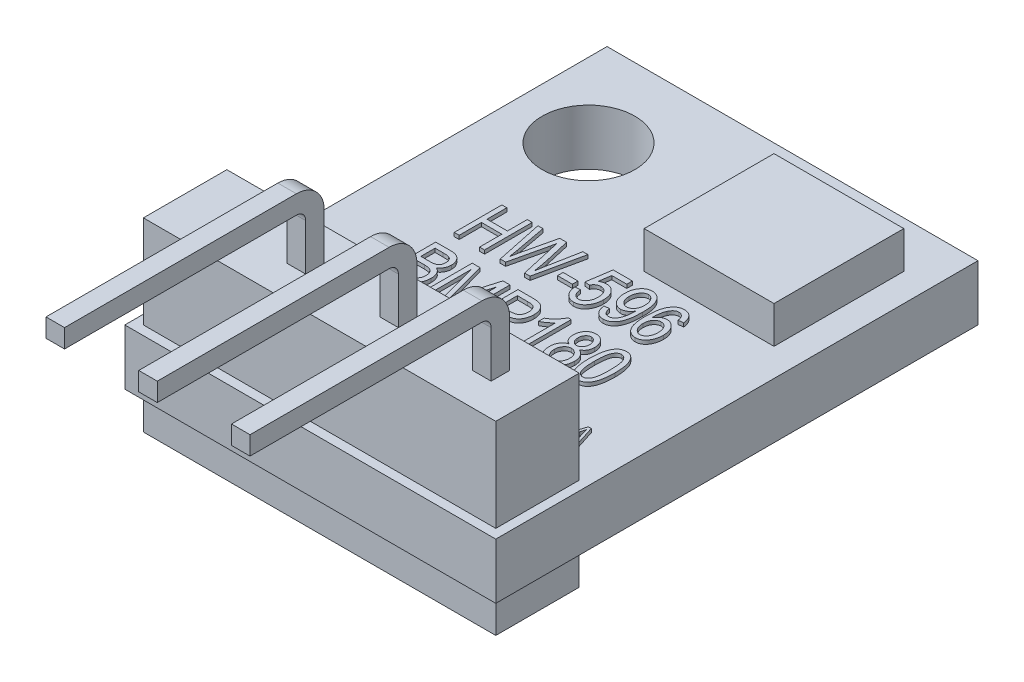
from build123d import *

# Parameters (mm, degrees)
SKETCH1_W           = 10
SKETCH1_H           = 13
SKETCH1_R           = 1.25
SKETCH1_W_2         = 9.5
SKETCH1_H_2         = 2.25
SKETCH1_W_3         = 3.5
SKETCH1_H_3         = 3.5
SKETCH1_W_4         = 0.5
SKETCH1_H_4         = 0.5
BOSS_EXTRUDE1_DEPTH = 1.5
SKETCH1_3_W         = 3.5
SKETCH1_3_H         = 3.5
BOSS_EXTRUDE2_DEPTH = 2.5
SKETCH1_5_W         = 9.5
SKETCH1_5_H         = 2.25
SKETCH1_5_W_2       = 0.5
SKETCH1_5_H_2       = 0.5
BOSS_EXTRUDE3_DEPTH = 1
BOSS_EXTRUDE4_START = 1.5
SKETCH1_6_W         = 9.5
SKETCH1_6_H         = 2.25
SKETCH1_6_W_2       = 0.5
SKETCH1_6_H_2       = 0.5
BOSS_EXTRUDE4_DEPTH = 2.5
SKETCH1_7_W         = 0.5
SKETCH1_7_H         = 0.5
LPATTERN1_COUNT     = 3
LPATTERN1_PITCH     = 2.5
BOSS_EXTRUDE5_START = 1.5
SKETCH3_W           = 0.080051491
SKETCH3_H           = 0.770495605
SKETCH3_W_2         = 0.400257457
SKETCH3_H_2         = 0.150096547
BOSS_EXTRUDE5_DEPTH = 0.1


with BuildPart() as part:
    # Sketch1 → Boss-Extrude1 (new body)
    # profile 1 of 3: a face of its own
    with BuildSketch(Plane(origin=(0, 0, 0), x_dir=(1, 0, 0), z_dir=(0, 1, 0))):
        with Locations((0, 5.125)):
            Rectangle(SKETCH1_W, SKETCH1_H)
        with Locations(Location((-3, 9.125, 0), (0, 0, 270))):
            Circle(SKETCH1_R, mode=Mode.SUBTRACT)
        Rectangle(SKETCH1_W_2, SKETCH1_H_2, mode=Mode.SUBTRACT)
        with Locations((2.5, 8.625)):
            Rectangle(SKETCH1_W_3, SKETCH1_H_3, mode=Mode.SUBTRACT)
    # profile 2 of 3: a face of its own
    with BuildSketch(Plane(origin=(0, 0, 0), x_dir=(1, 0, 0), z_dir=(0, 1, 0))):
        Rectangle(SKETCH1_W_2, SKETCH1_H_2)
        with Locations((3.5, 0)):
            Rectangle(SKETCH1_W_4, SKETCH1_H_4, mode=Mode.SUBTRACT)
    # profile 3 of 3: a face of its own
    with BuildSketch(Plane(origin=(0, 0, 0), x_dir=(1, 0, 0), z_dir=(0, 1, 0))):
        with Locations((3.5, 0)):
            Rectangle(SKETCH1_W_4, SKETCH1_H_4)
    extrude(amount=BOSS_EXTRUDE1_DEPTH)

    # Sketch1<3> → Boss-Extrude2 (add)
    with BuildSketch(Plane(origin=(0, 0, 0), x_dir=(1, 0, 0), z_dir=(0, 1, 0))):
        with Locations((2.5, 8.625)):
            Rectangle(SKETCH1_3_W, SKETCH1_3_H)
    extrude(amount=BOSS_EXTRUDE2_DEPTH)

    # Sketch1<5> → Boss-Extrude3 (add)
    # profile 1 of 2: a face of its own
    with BuildSketch(Plane(origin=(0, 0, 0), x_dir=(1, 0, 0), z_dir=(0, 1, 0))):
        Rectangle(SKETCH1_5_W, SKETCH1_5_H)
        with Locations((3.5, 0)):
            Rectangle(SKETCH1_5_W_2, SKETCH1_5_H_2, mode=Mode.SUBTRACT)
    # profile 2 of 2: a face of its own
    with BuildSketch(Plane(origin=(0, 0, 0), x_dir=(1, 0, 0), z_dir=(0, 1, 0))):
        with Locations((3.5, 0)):
            Rectangle(SKETCH1_5_W_2, SKETCH1_5_H_2)
    extrude(amount=-BOSS_EXTRUDE3_DEPTH)

    # Sketch1<6> → Boss-Extrude4 (add)
    # profile 1 of 2: a face of its own
    with BuildSketch(Plane(origin=(0, 0, 0), x_dir=(1, 0, 0), z_dir=(0, 1, 0)).offset(BOSS_EXTRUDE4_START)):
        Rectangle(SKETCH1_6_W, SKETCH1_6_H)
        with Locations((3.5, 0)):
            Rectangle(SKETCH1_6_W_2, SKETCH1_6_H_2, mode=Mode.SUBTRACT)
    # profile 2 of 2: a face of its own
    with BuildSketch(Plane(origin=(0, 0, 0), x_dir=(1, 0, 0), z_dir=(0, 1, 0)).offset(BOSS_EXTRUDE4_START)):
        with Locations((3.5, 0)):
            Rectangle(SKETCH1_6_W_2, SKETCH1_6_H_2)
    extrude(amount=BOSS_EXTRUDE4_DEPTH)

    # Sweep1: sweep along a path in Sketch2
    with BuildLine(Plane(origin=(3.5, 0, 0), x_dir=(0, 0, -1), z_dir=(1, 0, 0))) as sweep1_path:
        Line((0, 0), (0, 5.25))
        ThreePointArc((0, 5.25), (-0.146446609, 5.603553391), (-0.5, 5.75))
        Line((-0.5, 5.75), (-6.75, 5.75))
    # Sketch1<7> → Sweep1 (sweep)
    with BuildSketch(Plane(origin=(0, 0, 0), x_dir=(1, 0, 0), z_dir=(0, 1, 0))):
        with Locations((3.5, 0)):
            Rectangle(SKETCH1_7_W, SKETCH1_7_H)
    sweep1 = sweep(path=sweep1_path.line)

    # LPattern1: Sweep1 ×3
    with Locations(*[(-i * LPATTERN1_PITCH, 0, 0) for i in range(1, LPATTERN1_COUNT)]):
        add(sweep1)

    # Sketch3 → Boss-Extrude5 (add)
    # profile 1 of 24: a face of its own
    with BuildSketch(Plane(origin=(0, 0, 0), x_dir=(1, 0, 0), z_dir=(0, 1, 0)).offset(BOSS_EXTRUDE5_START)):
        with BuildLine():
            Line((2.300032182, 1.875160911), (2.380083674, 1.885167347))
            add(Edge.make_bspline(
                [(2.380083674, 1.885167347), (2.38124927, 1.874976145), (2.383459833, 1.855648452), (2.389514193, 1.828581683), (2.397611918, 1.805066225), (2.40761613, 1.784628339), (2.420436413, 1.76730393), (2.435080482, 1.751723519), (2.452329094, 1.738130942), (2.471637271, 1.72626454), (2.492889033, 1.716687388), (2.51568971, 1.710069846), (2.539717446, 1.705834412), (2.556168272, 1.705316321), (2.564577345, 1.705051491)],
                knots=[0, 0, 0, 0, 1.28056062, 2.428593037, 3.455857635, 4.381585452, 5.257863862, 6.137303782, 7.045121912, 7.991827123, 8.962072888, 9.946560163, 10.950355038, 12, 12, 12, 12], degree=3))
            add(Edge.make_bspline(
                [(2.564577345, 1.705051491), (2.570575738, 1.705173389), (2.582233126, 1.705410288), (2.599207632, 1.707192105), (2.615195867, 1.709876202), (2.630047483, 1.714051874), (2.644038572, 1.718934888), (2.656775268, 1.725444894), (2.668694083, 1.732802142), (2.679448861, 1.741367932), (2.688932215, 1.7509956), (2.69752822, 1.761099815), (2.704517423, 1.772161446), (2.710410926, 1.78374434), (2.714732856, 1.796133649), (2.718085064, 1.809082669), (2.719953911, 1.822833372), (2.720184491, 1.832211298), (2.720302512, 1.837011372)],
                knots=[0, 0, 0, 0, 1.25000475, 2.42928239, 3.554432982, 4.624373226, 5.641561959, 6.637472043, 7.59895824, 8.557494333, 9.494616268, 10.412591127, 11.316575992, 12.215324116, 13.115580924, 14.045624415, 14.999656403, 16, 16, 16, 16], degree=3))
            add(Edge.make_bspline(
                [(2.720302512, 1.837011372), (2.720130421, 1.842547532), (2.719795228, 1.853330628), (2.716942187, 1.869027955), (2.712077611, 1.883574793), (2.705455178, 1.897082496), (2.696902158, 1.909442591), (2.686339449, 1.920594596), (2.673788183, 1.930452402), (2.661811865, 1.937928405), (2.650242545, 1.943373624), (2.639312089, 1.948067334), (2.626148344, 1.95301842), (2.610772639, 1.958347356), (2.593180104, 1.963898958), (2.573361045, 1.969847317), (2.551384737, 1.976270416), (2.535919672, 1.980512472), (2.527834962, 1.982730103)],
                knots=[0, 0, 0, 0, 1.005239862, 1.957963033, 2.886140254, 3.783827184, 4.682063204, 5.60636897, 6.563082868, 7.574767638, 8.163399764, 8.884479363, 9.735568196, 10.717712603, 11.840607427, 13.08667948, 14.476996158, 16, 16, 16, 16], degree=3))
            add(Edge.make_bspline(
                [(2.527834962, 1.982730103), (2.520579479, 1.984777238), (2.506597046, 1.988722384), (2.486545862, 1.995036153), (2.468075883, 2.001164818), (2.451300955, 2.007703427), (2.436010405, 2.013913199), (2.42250525, 2.020577215), (2.410578669, 2.027102381), (2.396862555, 2.035758822), (2.381881229, 2.047865669), (2.366003101, 2.064043259), (2.352132529, 2.081956689), (2.340560025, 2.101604393), (2.331174184, 2.122745125), (2.324959167, 2.145533304), (2.32062443, 2.169508744), (2.320240608, 2.186017649), (2.320045055, 2.194428773)],
                knots=[0, 0, 0, 0, 1.113815205, 2.146493548, 3.105946624, 3.988323839, 4.806360381, 5.543364066, 6.212027532, 6.814445107, 7.937696897, 9.048553401, 10.157540001, 11.276136463, 12.410655589, 13.563606105, 14.758681343, 16, 16, 16, 16], degree=3))
            add(Edge.make_bspline(
                [(2.320045055, 2.194428773), (2.320217612, 2.201995172), (2.320556824, 2.216869188), (2.323452609, 2.238639228), (2.328042637, 2.259425217), (2.334891868, 2.279005145), (2.343271591, 2.297657873), (2.353883682, 2.315009009), (2.366154808, 2.331474361), (2.380361944, 2.34666257), (2.396009956, 2.36059175), (2.413277853, 2.372563948), (2.431801117, 2.382709202), (2.451583619, 2.391281026), (2.472807234, 2.397619395), (2.495270215, 2.402080941), (2.519002555, 2.405012767), (2.535278646, 2.405336173), (2.543626369, 2.405502042)],
                knots=[0, 0, 0, 0, 1.048547399, 2.061232895, 3.039277619, 3.994368589, 4.931972946, 5.868741773, 6.808014961, 7.774272834, 8.746911737, 9.706990873, 10.680354074, 11.670809819, 12.690200298, 13.744432806, 14.843158913, 16, 16, 16, 16], degree=3))
            add(Edge.make_bspline(
                [(2.543626369, 2.405502042), (2.555007089, 2.405184319), (2.577213865, 2.404564358), (2.609426274, 2.399379378), (2.639424421, 2.39059538), (2.667094265, 2.378372292), (2.692219773, 2.362941486), (2.714369998, 2.344209381), (2.73369403, 2.322594917), (2.749769777, 2.297865533), (2.762780889, 2.27058663), (2.772308357, 2.24087892), (2.778519686, 2.208901914), (2.779722718, 2.186744124), (2.780341131, 2.175354004)],
                knots=[0, 0, 0, 0, 1.10297814, 2.152200164, 3.153123011, 4.125894755, 5.076644034, 6.001845166, 6.928824672, 7.877651763, 8.851800581, 9.850539915, 10.895078977, 12, 12, 12, 12], degree=3))
            Line((2.780341131, 2.175354004), (2.70028964, 2.165347567))
            add(Edge.make_bspline(
                [(2.70028964, 2.165347567), (2.699702399, 2.171509042), (2.698557236, 2.183524394), (2.695393133, 2.200809086), (2.691349011, 2.216924822), (2.686278714, 2.231783489), (2.679907578, 2.245330057), (2.672814106, 2.257718612), (2.66455177, 2.268821142), (2.655333522, 2.278698594), (2.645058176, 2.287348404), (2.633863273, 2.294929703), (2.621653632, 2.301351275), (2.608407543, 2.306469483), (2.594297401, 2.310587747), (2.579151491, 2.31332668), (2.563054846, 2.315076504), (2.55196985, 2.315319487), (2.546284329, 2.315444114)],
                knots=[0, 0, 0, 0, 1.225165016, 2.389166377, 3.475498799, 4.513395989, 5.492249234, 6.435697439, 7.335638185, 8.226419293, 9.105162265, 9.989643781, 10.899061877, 11.830466535, 12.797276613, 13.805291738, 14.874328703, 16, 16, 16, 16], degree=3))
            add(Edge.make_bspline(
                [(2.546284329, 2.315444114), (2.540493217, 2.315394512), (2.529299787, 2.315298639), (2.513019733, 2.313407449), (2.49777506, 2.310909803), (2.483545077, 2.307106372), (2.470452411, 2.302306349), (2.458314913, 2.296445556), (2.447297423, 2.289470144), (2.437340279, 2.28142729), (2.42862022, 2.272484011), (2.420948986, 2.262972748), (2.414388667, 2.252856733), (2.409275551, 2.241983336), (2.405192108, 2.230514241), (2.402191031, 2.218426335), (2.400481826, 2.205682748), (2.400226681, 2.196987502), (2.400096547, 2.192552567)],
                knots=[0, 0, 0, 0, 1.28677749, 2.487165856, 3.639785246, 4.719183444, 5.756778416, 6.736320351, 7.710431992, 8.649732596, 9.575714218, 10.482424581, 11.363216052, 12.249555033, 13.147559346, 14.066626488, 15.013899474, 16, 16, 16, 16], degree=3))
            add(Edge.make_bspline(
                [(2.400096547, 2.192552567), (2.400361796, 2.18460291), (2.400866157, 2.169487007), (2.405581405, 2.14819302), (2.413429938, 2.129528649), (2.4213901, 2.119341402), (2.425268988, 2.114377282)],
                knots=[0, 0, 0, 0, 1.135097977, 2.158336086, 3.102579849, 4, 4, 4, 4], degree=3))
            add(Edge.make_bspline(
                [(2.425268988, 2.114377282), (2.42765064, 2.11200234), (2.432823465, 2.10684409), (2.442786149, 2.10034524), (2.454645164, 2.093508234), (2.469016697, 2.087307306), (2.485376975, 2.08080546), (2.50413907, 2.074844508), (2.525065021, 2.068676895), (2.539909632, 2.065014302), (2.547691484, 2.063094295)],
                knots=[0, 0, 0, 0, 0.600125557, 1.303441474, 2.117395318, 3.047759802, 4.098473224, 5.265768101, 6.566659033, 8, 8, 8, 8], degree=3))
            add(Edge.make_bspline(
                [(2.547691484, 2.063094295), (2.555359272, 2.061244449), (2.570092915, 2.057689972), (2.591222123, 2.052146298), (2.610633072, 2.047022112), (2.62829693, 2.042114581), (2.644091045, 2.037036858), (2.658154907, 2.03232923), (2.670568492, 2.02812532), (2.67805317, 2.024885282), (2.681527571, 2.023381251)],
                knots=[0, 0, 0, 0, 1.354590389, 2.602843464, 3.751324185, 4.802492375, 5.750771121, 6.599881396, 7.350062303, 8, 8, 8, 8], degree=3))
            add(Edge.make_bspline(
                [(2.681527571, 2.023381251), (2.690900564, 2.018847695), (2.709073127, 2.010057938), (2.733298013, 1.992828568), (2.754045907, 1.973251233), (2.770928866, 1.950891796), (2.784253734, 1.926242825), (2.793587353, 1.899206839), (2.799363532, 1.869985288), (2.800017723, 1.849755551), (2.800354004, 1.83935663)],
                knots=[0, 0, 0, 0, 1.070280572, 2.075083192, 3.046573603, 3.996247495, 4.946860593, 5.919165523, 6.930365132, 8, 8, 8, 8], degree=3))
            add(Edge.make_bspline(
                [(2.800354004, 1.83935663), (2.800013951, 1.828906028), (2.799342037, 1.808256599), (2.793378427, 1.778052336), (2.783634499, 1.749268599), (2.770005386, 1.722372641), (2.753326311, 1.697610184), (2.733698663, 1.675644057), (2.711034867, 1.657011496), (2.68565306, 1.641626032), (2.657551437, 1.62941844), (2.626609164, 1.621192392), (2.593060573, 1.615866746), (2.569758759, 1.615291373), (2.55769792, 1.614993564)],
                knots=[0, 0, 0, 0, 1.011281659, 1.998199493, 2.968653118, 3.946038549, 4.909179922, 5.852720419, 6.788493457, 7.73981833, 8.718701351, 9.744837575, 10.832745308, 12, 12, 12, 12], degree=3))
            add(Edge.make_bspline(
                [(2.55769792, 1.614993564), (2.548202731, 1.615192668), (2.529674111, 1.615581194), (2.5026713, 1.618926705), (2.477171678, 1.624370039), (2.453118449, 1.63204115), (2.430475387, 1.641929299), (2.409267293, 1.653989614), (2.389599434, 1.668305917), (2.371626673, 1.684777895), (2.35537321, 1.703053795), (2.341051334, 1.722981013), (2.328936698, 1.744607469), (2.31901579, 1.767756813), (2.310946756, 1.792387551), (2.305046312, 1.818555213), (2.301274591, 1.846341622), (2.300452833, 1.865403361), (2.300032182, 1.875160911)],
                knots=[0, 0, 0, 0, 1.104995383, 2.156254069, 3.161771291, 4.136451373, 5.090038804, 6.032932257, 6.970972664, 7.915738022, 8.865457713, 9.813334699, 10.766787024, 11.745048075, 12.740780621, 13.779854267, 14.863525297, 16, 16, 16, 16], degree=3))
        make_face()
    # profile 2 of 24: a face of its own
    with BuildSketch(Plane(origin=(0, 0, 0), x_dir=(1, 0, 0), z_dir=(0, 1, 0)).offset(BOSS_EXTRUDE5_START)):
        with BuildLine():
            Line((2.910424805, 1.625), (2.910424805, 2.395495605))
            Line((2.910424805, 2.395495605), (3.127595745, 2.395495605))
            add(Edge.make_bspline(
                [(3.127595745, 2.395495605), (3.134111545, 2.395497594), (3.146783583, 2.395501463), (3.165129303, 2.394617304), (3.182287573, 2.393587996), (3.198201155, 2.392065637), (3.212939757, 2.389958062), (3.226505827, 2.387787625), (3.238790529, 2.384739766), (3.246483598, 2.382393432), (3.250174592, 2.381267704)],
                knots=[0, 0, 0, 0, 1.26215185, 2.454654178, 3.557482523, 4.592303098, 5.550444389, 6.441834679, 7.252420792, 8, 8, 8, 8], degree=3))
            add(Edge.make_bspline(
                [(3.250174592, 2.381267704), (3.259158238, 2.377833682), (3.27713188, 2.370963213), (3.302072544, 2.355733029), (3.325043452, 2.336721386), (3.346218732, 2.314075912), (3.365203981, 2.287834236), (3.382155255, 2.258453247), (3.396653881, 2.225815938), (3.409012327, 2.190060776), (3.4188512, 2.15100029), (3.425776425, 2.108535328), (3.430022721, 2.06265989), (3.430508358, 2.030895732), (3.430759499, 2.014469268)],
                knots=[0, 0, 0, 0, 0.793557421, 1.587675775, 2.401718965, 3.251938517, 4.142780952, 5.072951786, 6.050439307, 7.089810771, 8.196152472, 9.375194853, 10.64261269, 12, 12, 12, 12], degree=3))
            add(Edge.make_bspline(
                [(3.430759499, 2.014469268), (3.430627891, 2.003783309), (3.430368996, 1.982762328), (3.428675703, 1.951875859), (3.425699943, 1.922192223), (3.421551896, 1.893791752), (3.41599707, 1.86663164), (3.409531986, 1.840651343), (3.401671053, 1.815931094), (3.392823032, 1.79253472), (3.382969752, 1.770621828), (3.372318749, 1.750291658), (3.361164884, 1.73151803), (3.349199203, 1.714474262), (3.336513751, 1.69913624), (3.323246682, 1.685320387), (3.309281764, 1.673141066), (3.294424873, 1.662802664), (3.278767842, 1.653722918), (3.261951826, 1.646152541), (3.244067436, 1.639491248), (3.224941748, 1.63428566), (3.204749433, 1.63001875), (3.183380903, 1.627082526), (3.160874275, 1.625382558), (3.145474787, 1.625129414), (3.137602182, 1.625)],
                knots=[0, 0, 0, 0, 1.386128034, 2.726734142, 4.010873419, 5.254715967, 6.447944792, 7.605518919, 8.725856033, 9.810649377, 10.848506109, 11.840315737, 12.786373227, 13.679144215, 14.538661634, 15.36577154, 16.161365935, 16.93783141, 17.710106602, 18.505700997, 19.327016474, 20.183204225, 21.074181726, 22.002513315, 22.978834581, 24, 24, 24, 24], degree=3))
            Line((3.137602182, 1.625), (2.910424805, 1.625))
        make_face()
        with BuildLine():
            Line((2.990476296, 1.715057928), (3.127908447, 1.715057928))
            add(Edge.make_bspline(
                [(3.127908447, 1.715057928), (3.134633969, 1.715151871), (3.147679991, 1.7153341), (3.166614427, 1.716623747), (3.184336114, 1.718530049), (3.200734255, 1.721630717), (3.215997331, 1.72497701), (3.229791838, 1.729879772), (3.242564329, 1.735037505), (3.254114265, 1.741399134), (3.26467479, 1.748708807), (3.274619264, 1.756811085), (3.283715374, 1.766197026), (3.292246037, 1.776470977), (3.300313349, 1.787657508), (3.30768425, 1.799867747), (3.314190462, 1.813230866), (3.318077642, 1.822554781), (3.320063296, 1.827317637)],
                knots=[0, 0, 0, 0, 1.342011219, 2.603204191, 3.786198351, 4.895972533, 5.932780973, 6.899736292, 7.813372447, 8.679106117, 9.524356621, 10.373947008, 11.234417048, 12.127941888, 13.037127478, 13.984247157, 14.970310281, 16, 16, 16, 16], degree=3))
            add(Edge.make_bspline(
                [(3.320063296, 1.827317637), (3.322534135, 1.834015399), (3.327545181, 1.847598965), (3.333789681, 1.868739559), (3.338835907, 1.890860934), (3.343351348, 1.913879061), (3.346462929, 1.937968713), (3.349073708, 1.962981516), (3.350433302, 1.988968866), (3.350615402, 2.006598318), (3.350708008, 2.015563722)],
                knots=[0, 0, 0, 0, 0.893165557, 1.811406971, 2.755792868, 3.73169534, 4.74530742, 5.793958353, 6.878124213, 8, 8, 8, 8], degree=3))
            add(Edge.make_bspline(
                [(3.350708008, 2.015563722), (3.350639693, 2.025103873), (3.350506698, 2.043676696), (3.348851472, 2.070740814), (3.346486397, 2.096220406), (3.342804511, 2.120099678), (3.338425916, 2.142436694), (3.332690132, 2.163180775), (3.326285348, 2.182438264), (3.318513131, 2.200030097), (3.310048369, 2.216106142), (3.3011839, 2.230915625), (3.291562764, 2.244254932), (3.281510745, 2.25637037), (3.270573429, 2.266834347), (3.259379095, 2.276199747), (3.247358692, 2.283936013), (3.238908505, 2.288059611), (3.234695885, 2.290115322)],
                knots=[0, 0, 0, 0, 1.456923081, 2.836346579, 4.140104769, 5.363837601, 6.525326372, 7.61445734, 8.64907664, 9.622216237, 10.547970715, 11.423056263, 12.255883474, 13.05801533, 13.823608501, 14.564597001, 15.284417456, 16, 16, 16, 16], degree=3))
            add(Edge.make_bspline(
                [(3.234695885, 2.290115322), (3.231640107, 2.291367203), (3.225210215, 2.29400138), (3.21466887, 2.297041528), (3.202919845, 2.299674731), (3.189931938, 2.301897355), (3.175663127, 2.303313096), (3.160140344, 2.304686383), (3.143337591, 2.305173742), (3.131712823, 2.305347892), (3.125719539, 2.305437678)],
                knots=[0, 0, 0, 0, 0.715245996, 1.505002602, 2.37361077, 3.324331965, 4.358357274, 5.480199528, 6.700887514, 8, 8, 8, 8], degree=3))
            Line((3.125719539, 2.305437678), (2.990476296, 2.305437678))
            Line((2.990476296, 2.305437678), (2.990476296, 1.715057928))
        make_face(mode=Mode.SUBTRACT)
    # profile 3 of 24: a face of its own
    with BuildSketch(Plane(origin=(0, 0, 0), x_dir=(1, 0, 0), z_dir=(0, 1, 0)).offset(BOSS_EXTRUDE5_START)):
        Polygon((3.480791681, 1.625), (3.726887478, 2.395495605), (3.804906412, 2.395495605), (4.051158558, 1.625), (3.967980055, 1.625), (3.90059296, 1.855148038), (3.63135728, 1.855148038), (3.564126535, 1.625), align=None)
        with BuildLine():
            Line((3.657624175, 1.945205966), (3.874169714, 1.945205966))
            Line((3.874169714, 1.945205966), (3.809753279, 2.156904637))
            add(Edge.make_bspline(
                [(3.809753279, 2.156904637), (3.807343444, 2.164822701), (3.802638593, 2.180281568), (3.795976094, 2.202918107), (3.789581609, 2.22438844), (3.784119487, 2.244842336), (3.778688058, 2.264013669), (3.77400382, 2.282115785), (3.769798936, 2.299058843), (3.767215932, 2.310021548), (3.76597512, 2.315287763)],
                knots=[0, 0, 0, 0, 1.20859176, 2.359599242, 3.445754582, 4.479676267, 5.450859039, 6.355343929, 7.209947359, 8, 8, 8, 8], degree=3))
            add(Edge.make_bspline(
                [(3.76597512, 2.315287763), (3.76372251, 2.303021313), (3.759220283, 2.278504707), (3.750781036, 2.241982678), (3.741392117, 2.205526555), (3.733918884, 2.181475158), (3.730170839, 2.169412682)],
                knots=[0, 0, 0, 0, 0.995500629, 1.989678841, 2.991765375, 4, 4, 4, 4], degree=3))
            Line((3.730170839, 2.169412682), (3.657624175, 1.945205966))
        make_face(mode=Mode.SUBTRACT)
    # profile 4 of 24: a face of its own
    with BuildSketch(Plane(origin=(0, 0, 0), x_dir=(1, 0, 0), z_dir=(0, 1, 0)).offset(BOSS_EXTRUDE5_START)):
        with BuildLine():
            Line((0.050032182, 1.875160911), (0.130083674, 1.885167347))
            add(Edge.make_bspline(
                [(0.130083674, 1.885167347), (0.13124927, 1.874976145), (0.133459833, 1.855648452), (0.139514193, 1.828581683), (0.147611918, 1.805066225), (0.15761613, 1.784628339), (0.170436413, 1.76730393), (0.185080482, 1.751723519), (0.202329094, 1.738130942), (0.221637271, 1.72626454), (0.242889033, 1.716687388), (0.26568971, 1.710069846), (0.289717446, 1.705834412), (0.306168272, 1.705316321), (0.314577345, 1.705051491)],
                knots=[0, 0, 0, 0, 1.28056062, 2.428593037, 3.455857635, 4.381585452, 5.257863862, 6.137303782, 7.045121912, 7.991827123, 8.962072888, 9.946560163, 10.950355038, 12, 12, 12, 12], degree=3))
            add(Edge.make_bspline(
                [(0.314577345, 1.705051491), (0.320575738, 1.705173389), (0.332233126, 1.705410288), (0.349207632, 1.707192105), (0.365195867, 1.709876202), (0.380047483, 1.714051874), (0.394038572, 1.718934888), (0.406775268, 1.725444894), (0.418694083, 1.732802142), (0.429448861, 1.741367932), (0.438932215, 1.7509956), (0.44752822, 1.761099815), (0.454517423, 1.772161446), (0.460410926, 1.78374434), (0.464732856, 1.796133649), (0.468085064, 1.809082669), (0.469953911, 1.822833372), (0.470184491, 1.832211298), (0.470302512, 1.837011372)],
                knots=[0, 0, 0, 0, 1.25000475, 2.42928239, 3.554432982, 4.624373226, 5.641561959, 6.637472043, 7.59895824, 8.557494333, 9.494616268, 10.412591127, 11.316575992, 12.215324116, 13.115580924, 14.045624415, 14.999656403, 16, 16, 16, 16], degree=3))
            add(Edge.make_bspline(
                [(0.470302512, 1.837011372), (0.470130421, 1.842547532), (0.469795228, 1.853330628), (0.466942187, 1.869027955), (0.462077611, 1.883574793), (0.455455178, 1.897082496), (0.446902158, 1.909442591), (0.436339449, 1.920594596), (0.423788183, 1.930452402), (0.411811865, 1.937928405), (0.400242545, 1.943373624), (0.389312089, 1.948067334), (0.376148344, 1.95301842), (0.360772639, 1.958347356), (0.343180104, 1.963898958), (0.323361045, 1.969847317), (0.301384737, 1.976270416), (0.285919672, 1.980512472), (0.277834962, 1.982730103)],
                knots=[0, 0, 0, 0, 1.005239862, 1.957963033, 2.886140254, 3.783827184, 4.682063204, 5.60636897, 6.563082868, 7.574767638, 8.163399764, 8.884479363, 9.735568196, 10.717712603, 11.840607427, 13.08667948, 14.476996158, 16, 16, 16, 16], degree=3))
            add(Edge.make_bspline(
                [(0.277834962, 1.982730103), (0.270579479, 1.984777238), (0.256597046, 1.988722384), (0.236545862, 1.995036153), (0.218075883, 2.001164818), (0.201300955, 2.007703427), (0.186010405, 2.013913199), (0.17250525, 2.020577215), (0.160578669, 2.027102381), (0.146862555, 2.035758822), (0.131881229, 2.047865669), (0.116003101, 2.064043259), (0.102132529, 2.081956689), (0.090560025, 2.101604393), (0.081174184, 2.122745125), (0.074959167, 2.145533304), (0.07062443, 2.169508744), (0.070240608, 2.186017649), (0.070045055, 2.194428773)],
                knots=[0, 0, 0, 0, 1.113815205, 2.146493548, 3.105946624, 3.988323839, 4.806360381, 5.543364066, 6.212027532, 6.814445107, 7.937696897, 9.048553401, 10.157540001, 11.276136463, 12.410655589, 13.563606105, 14.758681343, 16, 16, 16, 16], degree=3))
            add(Edge.make_bspline(
                [(0.070045055, 2.194428773), (0.070217612, 2.201995172), (0.070556824, 2.216869188), (0.073452609, 2.238639228), (0.078042637, 2.259425217), (0.084891868, 2.279005145), (0.093271591, 2.297657873), (0.103883682, 2.315009009), (0.116154808, 2.331474361), (0.130361944, 2.34666257), (0.146009956, 2.36059175), (0.163277853, 2.372563948), (0.181801117, 2.382709202), (0.201583619, 2.391281026), (0.222807234, 2.397619395), (0.245270215, 2.402080941), (0.269002555, 2.405012767), (0.285278646, 2.405336173), (0.293626369, 2.405502042)],
                knots=[0, 0, 0, 0, 1.048547399, 2.061232895, 3.039277619, 3.994368589, 4.931972946, 5.868741773, 6.808014961, 7.774272834, 8.746911737, 9.706990873, 10.680354074, 11.670809819, 12.690200298, 13.744432806, 14.843158913, 16, 16, 16, 16], degree=3))
            add(Edge.make_bspline(
                [(0.293626369, 2.405502042), (0.305007089, 2.405184319), (0.327213865, 2.404564358), (0.359426274, 2.399379378), (0.389424421, 2.39059538), (0.417094265, 2.378372292), (0.442219773, 2.362941486), (0.464369998, 2.344209381), (0.48369403, 2.322594917), (0.499769777, 2.297865533), (0.512780889, 2.27058663), (0.522308357, 2.24087892), (0.528519686, 2.208901914), (0.529722718, 2.186744124), (0.530341131, 2.175354004)],
                knots=[0, 0, 0, 0, 1.10297814, 2.152200164, 3.153123011, 4.125894755, 5.076644034, 6.001845166, 6.928824672, 7.877651763, 8.851800581, 9.850539915, 10.895078977, 12, 12, 12, 12], degree=3))
            Line((0.530341131, 2.175354004), (0.45028964, 2.165347567))
            add(Edge.make_bspline(
                [(0.45028964, 2.165347567), (0.449702399, 2.171509042), (0.448557236, 2.183524394), (0.445393133, 2.200809086), (0.441349011, 2.216924822), (0.436278714, 2.231783489), (0.429907578, 2.245330057), (0.422814106, 2.257718612), (0.41455177, 2.268821142), (0.405333522, 2.278698594), (0.395058176, 2.287348404), (0.383863273, 2.294929703), (0.371653632, 2.301351275), (0.358407543, 2.306469483), (0.344297401, 2.310587747), (0.329151491, 2.31332668), (0.313054846, 2.315076504), (0.30196985, 2.315319487), (0.296284329, 2.315444114)],
                knots=[0, 0, 0, 0, 1.225165016, 2.389166377, 3.475498799, 4.513395989, 5.492249234, 6.435697439, 7.335638185, 8.226419293, 9.105162265, 9.989643781, 10.899061877, 11.830466535, 12.797276613, 13.805291738, 14.874328703, 16, 16, 16, 16], degree=3))
            add(Edge.make_bspline(
                [(0.296284329, 2.315444114), (0.290493217, 2.315394512), (0.279299787, 2.315298639), (0.263019733, 2.313407449), (0.24777506, 2.310909803), (0.233545077, 2.307106372), (0.220452411, 2.302306349), (0.208314913, 2.296445556), (0.197297423, 2.289470144), (0.187340279, 2.28142729), (0.17862022, 2.272484011), (0.170948986, 2.262972748), (0.164388667, 2.252856733), (0.159275551, 2.241983336), (0.155192108, 2.230514241), (0.152191031, 2.218426335), (0.150481826, 2.205682748), (0.150226681, 2.196987502), (0.150096547, 2.192552567)],
                knots=[0, 0, 0, 0, 1.28677749, 2.487165856, 3.639785246, 4.719183444, 5.756778416, 6.736320351, 7.710431992, 8.649732596, 9.575714218, 10.482424581, 11.363216052, 12.249555033, 13.147559346, 14.066626488, 15.013899474, 16, 16, 16, 16], degree=3))
            add(Edge.make_bspline(
                [(0.150096547, 2.192552567), (0.150361796, 2.18460291), (0.150866157, 2.169487007), (0.155581405, 2.14819302), (0.163429938, 2.129528649), (0.1713901, 2.119341402), (0.175268988, 2.114377282)],
                knots=[0, 0, 0, 0, 1.135097977, 2.158336086, 3.102579849, 4, 4, 4, 4], degree=3))
            add(Edge.make_bspline(
                [(0.175268988, 2.114377282), (0.17765064, 2.11200234), (0.182823465, 2.10684409), (0.192786149, 2.10034524), (0.204645164, 2.093508234), (0.219016697, 2.087307306), (0.235376975, 2.08080546), (0.25413907, 2.074844508), (0.275065021, 2.068676895), (0.289909632, 2.065014302), (0.297691484, 2.063094295)],
                knots=[0, 0, 0, 0, 0.600125557, 1.303441474, 2.117395318, 3.047759802, 4.098473224, 5.265768101, 6.566659033, 8, 8, 8, 8], degree=3))
            add(Edge.make_bspline(
                [(0.297691484, 2.063094295), (0.305359272, 2.061244449), (0.320092915, 2.057689972), (0.341222123, 2.052146298), (0.360633072, 2.047022112), (0.37829693, 2.042114581), (0.394091045, 2.037036858), (0.408154907, 2.03232923), (0.420568492, 2.02812532), (0.42805317, 2.024885282), (0.431527571, 2.023381251)],
                knots=[0, 0, 0, 0, 1.354590389, 2.602843464, 3.751324185, 4.802492375, 5.750771121, 6.599881396, 7.350062303, 8, 8, 8, 8], degree=3))
            add(Edge.make_bspline(
                [(0.431527571, 2.023381251), (0.440900564, 2.018847695), (0.459073127, 2.010057938), (0.483298013, 1.992828568), (0.504045907, 1.973251233), (0.520928866, 1.950891796), (0.534253734, 1.926242825), (0.543587353, 1.899206839), (0.549363532, 1.869985288), (0.550017723, 1.849755551), (0.550354004, 1.83935663)],
                knots=[0, 0, 0, 0, 1.070280572, 2.075083192, 3.046573603, 3.996247495, 4.946860593, 5.919165523, 6.930365132, 8, 8, 8, 8], degree=3))
            add(Edge.make_bspline(
                [(0.550354004, 1.83935663), (0.550013951, 1.828906028), (0.549342037, 1.808256599), (0.543378427, 1.778052336), (0.533634499, 1.749268599), (0.520005386, 1.722372641), (0.503326311, 1.697610184), (0.483698663, 1.675644057), (0.461034867, 1.657011496), (0.43565306, 1.641626032), (0.407551437, 1.62941844), (0.376609164, 1.621192392), (0.343060573, 1.615866746), (0.319758759, 1.615291373), (0.30769792, 1.614993564)],
                knots=[0, 0, 0, 0, 1.011281659, 1.998199493, 2.968653118, 3.946038549, 4.909179922, 5.852720419, 6.788493457, 7.73981833, 8.718701351, 9.744837575, 10.832745308, 12, 12, 12, 12], degree=3))
            add(Edge.make_bspline(
                [(0.30769792, 1.614993564), (0.298202731, 1.615192668), (0.279674111, 1.615581194), (0.2526713, 1.618926705), (0.227171678, 1.624370039), (0.203118449, 1.63204115), (0.180475387, 1.641929299), (0.159267293, 1.653989614), (0.139599434, 1.668305917), (0.121626673, 1.684777895), (0.10537321, 1.703053795), (0.091051334, 1.722981013), (0.078936698, 1.744607469), (0.06901579, 1.767756813), (0.060946756, 1.792387551), (0.055046312, 1.818555213), (0.051274591, 1.846341622), (0.050452833, 1.865403361), (0.050032182, 1.875160911)],
                knots=[0, 0, 0, 0, 1.104995383, 2.156254069, 3.161771291, 4.136451373, 5.090038804, 6.032932257, 6.970972664, 7.915738022, 8.865457713, 9.813334699, 10.766787024, 11.745048075, 12.740780621, 13.779854267, 14.863525297, 16, 16, 16, 16], degree=3))
        make_face()
    # profile 5 of 24: a face of its own
    with BuildSketch(Plane(origin=(0, 0, 0), x_dir=(1, 0, 0), z_dir=(0, 1, 0)).offset(BOSS_EXTRUDE5_START)):
        with BuildLine():
            Line((1.110714444, 1.895173784), (1.190765936, 1.875160911))
            add(Edge.make_bspline(
                [(1.190765936, 1.875160911), (1.188379987, 1.864552619), (1.183728383, 1.843870875), (1.17500351, 1.814123771), (1.164808302, 1.786516148), (1.153421948, 1.760943418), (1.140753144, 1.737401658), (1.126864251, 1.715907061), (1.111638355, 1.696477196), (1.094999615, 1.679351326), (1.077503461, 1.663984886), (1.058742373, 1.651086251), (1.039280788, 1.639781778), (1.018746861, 1.630778254), (0.997347852, 1.623647041), (0.974968557, 1.618727596), (0.951699905, 1.615430965), (0.935821876, 1.615140566), (0.927784278, 1.614993564)],
                knots=[0, 0, 0, 0, 1.289221957, 2.51344498, 3.673011535, 4.776835723, 5.830430132, 6.840130389, 7.808269491, 8.7523986, 9.668123701, 10.564817631, 11.447926293, 12.333367568, 13.218722559, 14.118350969, 15.047492789, 16, 16, 16, 16], degree=3))
            add(Edge.make_bspline(
                [(0.927784278, 1.614993564), (0.920690426, 1.615091448), (0.906784811, 1.615283325), (0.886320781, 1.617452383), (0.866594282, 1.620620695), (0.847650983, 1.625390657), (0.829449155, 1.631230055), (0.812164536, 1.63872954), (0.795516267, 1.647264467), (0.779694897, 1.657351006), (0.764512458, 1.668777752), (0.7503764, 1.682063713), (0.736602948, 1.69658678), (0.723897924, 1.713040914), (0.711398903, 1.730770113), (0.700162112, 1.750437267), (0.689261084, 1.771466987), (0.679222133, 1.794028367), (0.669871521, 1.817894536), (0.662235542, 1.843100926), (0.655425112, 1.869208846), (0.650020012, 1.896420647), (0.645560344, 1.924623275), (0.64273622, 1.953969795), (0.640740183, 1.984318137), (0.640522572, 2.004928422), (0.640411932, 2.015407372)],
                knots=[0, 0, 0, 0, 0.921095259, 1.805562833, 2.670327692, 3.514278933, 4.340642213, 5.150451062, 5.958900505, 6.768369716, 7.58482939, 8.423223242, 9.285360719, 10.181948201, 11.120907027, 12.10087379, 13.121233649, 14.196976745, 15.307105309, 16.44839936, 17.61583717, 18.810746038, 20.050660639, 21.323136918, 22.638994396, 24, 24, 24, 24], degree=3))
            add(Edge.make_bspline(
                [(0.640411932, 2.015407372), (0.640521669, 2.025730074), (0.640736898, 2.045976111), (0.642729666, 2.075699794), (0.645546604, 2.104268188), (0.650021985, 2.131583237), (0.655390111, 2.157763803), (0.662175119, 2.182635648), (0.669925362, 2.206403394), (0.679141333, 2.228839744), (0.689526543, 2.249962577), (0.700624009, 2.269859786), (0.712459457, 2.288533176), (0.725303785, 2.305791456), (0.73908842, 2.321591775), (0.753701483, 2.336092362), (0.769218856, 2.349203028), (0.78546099, 2.361161013), (0.802481262, 2.371524908), (0.819928649, 2.380728626), (0.837934402, 2.388365232), (0.856432811, 2.394640552), (0.875405996, 2.399518539), (0.894861104, 2.402872391), (0.914749141, 2.405237946), (0.92819414, 2.40541349), (0.934976404, 2.405502042)],
                knots=[0, 0, 0, 0, 1.355009242, 2.657595594, 3.909622363, 5.12221665, 6.289669639, 7.416642245, 8.504963989, 9.569716403, 10.597874851, 11.593392335, 12.559484071, 13.498222117, 14.414780627, 15.309839368, 16.198178116, 17.079506653, 17.954919271, 18.811820418, 19.667108407, 20.519600343, 21.37423126, 22.235899437, 23.110108003, 24, 24, 24, 24], degree=3))
            add(Edge.make_bspline(
                [(0.934976404, 2.405502042), (0.942383614, 2.405310271), (0.956933888, 2.404933567), (0.978425313, 2.402295598), (0.998984273, 2.39749775), (1.018956596, 2.391316514), (1.037967481, 2.382960553), (1.056262558, 2.372907713), (1.073682259, 2.360946106), (1.090237958, 2.34714941), (1.105911681, 2.331688404), (1.120348393, 2.314401125), (1.133416304, 2.295364214), (1.145623282, 2.274844218), (1.156137025, 2.252340992), (1.165616578, 2.228250275), (1.174247482, 2.202530932), (1.178552377, 2.184565098), (1.180759499, 2.175354004)],
                knots=[0, 0, 0, 0, 0.969230344, 1.90389736, 2.827024372, 3.728538081, 4.635631584, 5.539103428, 6.456494714, 7.396000419, 8.355610671, 9.333534695, 10.338037519, 11.374284513, 12.454112223, 13.583699076, 14.761161004, 16, 16, 16, 16], degree=3))
            Line((1.180759499, 2.175354004), (1.100708008, 2.155341131))
            add(Edge.make_bspline(
                [(1.100708008, 2.155341131), (1.098898681, 2.161823913), (1.09536995, 2.174467284), (1.089090474, 2.19262702), (1.082222454, 2.20954686), (1.074758239, 2.225272484), (1.06644623, 2.239667434), (1.057529365, 2.252849016), (1.047992382, 2.264853925), (1.037634964, 2.275429029), (1.02680182, 2.284970726), (1.015160988, 2.293144676), (1.002809121, 2.299973255), (0.989857836, 2.305713506), (0.976266205, 2.3100312), (0.961989536, 2.313211498), (0.947065776, 2.3150874), (0.936857836, 2.315324269), (0.931693042, 2.315444114)],
                knots=[0, 0, 0, 0, 1.274827499, 2.486296693, 3.637698816, 4.732866786, 5.781146847, 6.783409552, 7.745577291, 8.681189198, 9.583979081, 10.476943643, 11.369744444, 12.253932728, 13.156290603, 14.066553906, 15.021756508, 16, 16, 16, 16], degree=3))
            add(Edge.make_bspline(
                [(0.931693042, 2.315444114), (0.921498759, 2.315066426), (0.901606161, 2.314329425), (0.872835436, 2.30819895), (0.846065901, 2.298393019), (0.825691483, 2.286626498), (0.810585064, 2.275340645), (0.799877369, 2.265692107), (0.789795137, 2.254920737), (0.780215631, 2.243129107), (0.771141411, 2.230220771), (0.762958381, 2.216038583), (0.755022298, 2.200984888), (0.747871039, 2.184738351), (0.741500228, 2.167388307), (0.735833772, 2.148972303), (0.731000899, 2.129457747), (0.727102475, 2.108785242), (0.724203871, 2.087013236), (0.721969063, 2.06412382), (0.720769063, 2.040123655), (0.720566554, 2.023747244), (0.720463423, 2.015407372)],
                knots=[0, 0, 0, 0, 1.477189771, 2.882511776, 4.245778241, 5.596752156, 6.277022015, 6.978177212, 7.684002091, 8.414723124, 9.180080371, 9.969542299, 10.787683758, 11.647234596, 12.541638645, 13.466905688, 14.440346501, 15.45581228, 16.516221105, 17.624831929, 18.790418795, 20, 20, 20, 20], degree=3))
            add(Edge.make_bspline(
                [(0.720463423, 2.015407372), (0.720661172, 2.002895404), (0.72104472, 1.978627518), (0.723490372, 1.943382633), (0.727769179, 1.910513201), (0.734050471, 1.880128794), (0.741809201, 1.852131641), (0.751248897, 1.826511029), (0.762727377, 1.803374526), (0.775840994, 1.782674001), (0.7904727, 1.764424394), (0.806259427, 1.748524089), (0.823300807, 1.735135529), (0.841389864, 1.724003323), (0.860795937, 1.715583076), (0.881246547, 1.709423812), (0.902898552, 1.705770076), (0.917711758, 1.705294536), (0.925282669, 1.705051491)],
                knots=[0, 0, 0, 0, 1.437104972, 2.787371166, 4.055570009, 5.241294904, 6.348053785, 7.389870239, 8.372351441, 9.308936623, 10.198930124, 11.053953419, 11.87666206, 12.682560998, 13.486679433, 14.299132302, 15.130700221, 16, 16, 16, 16], degree=3))
            add(Edge.make_bspline(
                [(0.925282669, 1.705051491), (0.930918937, 1.705206506), (0.942025819, 1.70551198), (0.958400405, 1.707793806), (0.974238996, 1.711322169), (0.989501457, 1.716500553), (1.004023413, 1.723326021), (1.018097899, 1.731272636), (1.031434138, 1.740956123), (1.044218603, 1.75197287), (1.056188332, 1.764573147), (1.067130798, 1.778743742), (1.077211076, 1.794369173), (1.085858651, 1.811707687), (1.093722155, 1.830395948), (1.100586557, 1.850606215), (1.106381517, 1.872338373), (1.10924691, 1.887439577), (1.110714444, 1.895173784)],
                knots=[0, 0, 0, 0, 0.928044623, 1.828813311, 2.717973564, 3.597468745, 4.476963925, 5.35746386, 6.25552913, 7.186585864, 8.133765821, 9.112470931, 10.131597503, 11.191133367, 12.299110282, 13.469062082, 14.703759174, 16, 16, 16, 16], degree=3))
        make_face()
    # profile 6 of 24: a face of its own
    with BuildSketch(Plane(origin=(0, 0, 0), x_dir=(1, 0, 0), z_dir=(0, 1, 0)).offset(BOSS_EXTRUDE5_START)):
        Polygon((1.300836737, 1.625), (1.300836737, 2.395495605), (1.380888228, 2.395495605), (1.380888228, 1.715057928), (1.701094194, 1.715057928), (1.701094194, 1.625), align=None)
    # profile 7 of 24: a face of its own
    with BuildSketch(Plane(origin=(0, 0, 0), x_dir=(1, 0, 0), z_dir=(0, 1, 0)).offset(BOSS_EXTRUDE5_START)):
        with BuildLine():
            Line((-1.879761852, 1.925193093), (-1.879761852, 2.015251021))
            Line((-1.879761852, 2.015251021), (-1.609588068, 2.015251021))
            Line((-1.609588068, 2.015251021), (-1.609588068, 1.733038243))
            add(Edge.make_bspline(
                [(-1.609588068, 1.733038243), (-1.619862536, 1.723688774), (-1.63997131, 1.705390368), (-1.67202026, 1.681499619), (-1.70446786, 1.660963741), (-1.737488642, 1.644185364), (-1.771023208, 1.631007358), (-1.805050323, 1.621806229), (-1.839595676, 1.616097556), (-1.862802356, 1.615362411), (-1.874445933, 1.614993564)],
                knots=[0, 0, 0, 0, 1.121144615, 2.194259096, 3.22291754, 4.218514423, 5.180530362, 6.126881594, 7.060193117, 8, 8, 8, 8], degree=3))
            add(Edge.make_bspline(
                [(-1.874445933, 1.614993564), (-1.882110494, 1.615171702), (-1.897309374, 1.615524951), (-1.919790799, 1.617491266), (-1.941663141, 1.621164862), (-1.962881558, 1.626127437), (-1.983510602, 1.63251397), (-2.003369745, 1.640642903), (-2.022829557, 1.649727808), (-2.041433766, 1.660607794), (-2.059251594, 1.672782658), (-2.076165536, 1.686281644), (-2.09220899, 1.700967068), (-2.107090892, 1.717230907), (-2.121083756, 1.734711645), (-2.134364785, 1.753350355), (-2.146327368, 1.773531457), (-2.157640684, 1.794838096), (-2.167585943, 1.817474414), (-2.176227899, 1.841245446), (-2.183530406, 1.866113672), (-2.189656337, 1.892093588), (-2.194336239, 1.919193416), (-2.197530572, 1.947386671), (-2.199669995, 1.976651438), (-2.199867407, 1.996537137), (-2.199967818, 2.00665174)],
                knots=[0, 0, 0, 0, 0.963545397, 1.910717405, 2.833679837, 3.748938136, 4.648160849, 5.544707014, 6.44428759, 7.345417256, 8.250301349, 9.15471106, 10.063381295, 10.981308332, 11.922549023, 12.876762963, 13.855312354, 14.869185747, 15.907484256, 16.960251447, 18.046404778, 19.163470092, 20.313696906, 21.500864286, 22.728847097, 24, 24, 24, 24], degree=3))
            add(Edge.make_bspline(
                [(-2.199967818, 2.00665174), (-2.199863171, 2.016922195), (-2.199657381, 2.037119279), (-2.197572649, 2.066916499), (-2.194147368, 2.095663606), (-2.189430609, 2.123417825), (-2.183597464, 2.150250308), (-2.17602058, 2.175998508), (-2.167305091, 2.200763349), (-2.157248891, 2.224376806), (-2.146263458, 2.246817518), (-2.13418273, 2.267767508), (-2.121409575, 2.287289638), (-2.107540036, 2.305063296), (-2.093218945, 2.321648921), (-2.07783253, 2.336485843), (-2.06168996, 2.349907449), (-2.044557519, 2.361607232), (-2.02669726, 2.371986598), (-2.007993795, 2.380881428), (-1.988586465, 2.38858133), (-1.968377175, 2.394886303), (-1.947324166, 2.399494501), (-1.925502395, 2.402918943), (-1.902899262, 2.405233859), (-1.887533052, 2.405411967), (-1.879761852, 2.405502042)],
                knots=[0, 0, 0, 0, 1.283121513, 2.523287582, 3.730023389, 4.899079804, 6.039789461, 7.15880579, 8.250410031, 9.318392136, 10.363902253, 11.370311636, 12.338384822, 13.276198214, 14.185288112, 15.074093801, 15.943727649, 16.805327304, 17.663128848, 18.522362821, 19.39060582, 20.270106898, 21.164311373, 22.080741752, 23.02936765, 24, 24, 24, 24], degree=3))
            add(Edge.make_bspline(
                [(-1.879761852, 2.405502042), (-1.868433879, 2.405232549), (-1.846397283, 2.404708296), (-1.814447986, 2.399758243), (-1.784647831, 2.391699599), (-1.757110902, 2.380182715), (-1.731832217, 2.365744638), (-1.708818503, 2.348588872), (-1.688133141, 2.328718796), (-1.673006368, 2.3098571), (-1.662042647, 2.293359466), (-1.654337267, 2.279765508), (-1.647157773, 2.265104956), (-1.640634006, 2.249245626), (-1.634546613, 2.232338561), (-1.628896711, 2.21436071), (-1.623922563, 2.195244756), (-1.621059696, 2.182087683), (-1.619594505, 2.175354004)],
                knots=[0, 0, 0, 0, 1.421442541, 2.765168547, 4.047841273, 5.288586259, 6.501956771, 7.694182091, 8.88353085, 10.093491299, 10.721426975, 11.369099503, 12.053886711, 12.769643166, 13.521004755, 14.309514717, 15.134823968, 16, 16, 16, 16], degree=3))
            Line((-1.619594505, 2.175354004), (-1.699645996, 2.155341131))
            add(Edge.make_bspline(
                [(-1.699645996, 2.155341131), (-1.702259579, 2.165183094), (-1.707180084, 2.183712226), (-1.716369027, 2.209242398), (-1.726600118, 2.230831464), (-1.738038796, 2.248927668), (-1.751181075, 2.263991724), (-1.765737664, 2.277323534), (-1.782544234, 2.288468376), (-1.800788362, 2.298274657), (-1.820688337, 2.305808251), (-1.84176121, 2.311549198), (-1.864127556, 2.314837574), (-1.879438624, 2.315238919), (-1.887266679, 2.315444114)],
                knots=[0, 0, 0, 0, 1.35370667, 2.548578037, 3.602482135, 4.525244969, 5.385205021, 6.25372376, 7.141792941, 8.059466754, 9.00287123, 9.96447941, 10.959304047, 12, 12, 12, 12], degree=3))
            add(Edge.make_bspline(
                [(-1.887266679, 2.315444114), (-1.893003276, 2.315368929), (-1.904290347, 2.315220998), (-1.920955183, 2.313604593), (-1.936990167, 2.310977448), (-1.952430217, 2.30730867), (-1.967316836, 2.302932887), (-1.981438442, 2.296972551), (-1.995052493, 2.29030315), (-2.008100314, 2.282615358), (-2.020545542, 2.273835701), (-2.032240885, 2.263762565), (-2.043396012, 2.252692115), (-2.053734703, 2.240272755), (-2.063759246, 2.22696141), (-2.072946539, 2.212312077), (-2.081599426, 2.19661766), (-2.089500265, 2.179788876), (-2.096746153, 2.161918969), (-2.102980186, 2.143068309), (-2.108075394, 2.123189435), (-2.112544776, 2.102455874), (-2.115678782, 2.080656713), (-2.118292279, 2.057936515), (-2.119638354, 2.034238051), (-2.119822723, 2.018118818), (-2.119916326, 2.009935102)],
                knots=[0, 0, 0, 0, 0.95244652, 1.873991161, 2.777557121, 3.648832578, 4.508552549, 5.350797697, 6.190771618, 7.02501797, 7.86316154, 8.7165405, 9.585620601, 10.469996113, 11.397859992, 12.351132043, 13.338946381, 14.372712626, 15.436726846, 16.539770861, 17.66713286, 18.84353329, 20.060284837, 21.322933361, 22.640856277, 24, 24, 24, 24], degree=3))
            add(Edge.make_bspline(
                [(-2.119916326, 2.009935102), (-2.119709385, 1.997628229), (-2.119307948, 1.97375469), (-2.116129524, 1.939126393), (-2.111102418, 1.906798165), (-2.103778971, 1.876874073), (-2.094402942, 1.849329072), (-2.083012408, 1.824111578), (-2.069399175, 1.801317831), (-2.053652864, 1.781041537), (-2.036248338, 1.763215072), (-2.017560433, 1.747627058), (-1.997635387, 1.734354918), (-1.976303329, 1.723738074), (-1.953877378, 1.715174036), (-1.930100029, 1.709261559), (-1.905087876, 1.705815666), (-1.88800716, 1.705309653), (-1.8792928, 1.705051491)],
                knots=[0, 0, 0, 0, 1.344305217, 2.607756079, 3.795613497, 4.915552292, 5.968887625, 6.970219091, 7.933010886, 8.862341374, 9.768284732, 10.649651063, 11.516609893, 12.377263757, 13.247581458, 14.134137142, 15.048060964, 16, 16, 16, 16], degree=3))
            add(Edge.make_bspline(
                [(-1.8792928, 1.705051491), (-1.870728308, 1.705321714), (-1.85333421, 1.705870525), (-1.8271701, 1.710453418), (-1.800766062, 1.717902344), (-1.77464369, 1.72794659), (-1.749745549, 1.739954255), (-1.726931386, 1.753161811), (-1.70688939, 1.767677635), (-1.695270032, 1.778572688), (-1.68963956, 1.783852178)],
                knots=[0, 0, 0, 0, 0.978162575, 1.986604247, 3.025534994, 4.109442341, 5.180230685, 6.181206173, 7.118654505, 8, 8, 8, 8], degree=3))
            Line((-1.68963956, 1.783852178), (-1.68963956, 1.925193093))
            Line((-1.68963956, 1.925193093), (-1.879761852, 1.925193093))
        make_face()
    # profile 8 of 24: a face of its own
    with BuildSketch(Plane(origin=(0, 0, 0), x_dir=(1, 0, 0), z_dir=(0, 1, 0)).offset(BOSS_EXTRUDE5_START)):
        Polygon((-1.489510831, 1.625), (-1.489510831, 2.395495605), (-1.404299771, 2.395495605), (-1.079246937, 1.781350569), (-1.079246937, 2.395495605), (-0.999195446, 2.395495605), (-0.999195446, 1.625), (-1.084875558, 1.625), (-1.409459339, 2.238363283), (-1.409459339, 1.625), align=None)
    # profile 9 of 24: a face of its own
    with BuildSketch(Plane(origin=(0, 0, 0), x_dir=(1, 0, 0), z_dir=(0, 1, 0)).offset(BOSS_EXTRUDE5_START)):
        with BuildLine():
            Line((-0.849098899, 1.625), (-0.849098899, 2.395495605))
            Line((-0.849098899, 2.395495605), (-0.631927958, 2.395495605))
            add(Edge.make_bspline(
                [(-0.631927958, 2.395495605), (-0.625412158, 2.395497594), (-0.612740121, 2.395501463), (-0.594394401, 2.394617304), (-0.57723613, 2.393587996), (-0.561322549, 2.392065637), (-0.546583946, 2.389958062), (-0.533017877, 2.387787625), (-0.520733174, 2.384739766), (-0.513040106, 2.382393432), (-0.509349112, 2.381267704)],
                knots=[0, 0, 0, 0, 1.26215185, 2.454654178, 3.557482523, 4.592303098, 5.550444389, 6.441834679, 7.252420792, 8, 8, 8, 8], degree=3))
            add(Edge.make_bspline(
                [(-0.509349112, 2.381267704), (-0.500365466, 2.377833682), (-0.482391824, 2.370963213), (-0.457451159, 2.355733029), (-0.434480252, 2.336721386), (-0.413304972, 2.314075912), (-0.394319723, 2.287834236), (-0.377368449, 2.258453247), (-0.362869823, 2.225815938), (-0.350511377, 2.190060776), (-0.340672504, 2.15100029), (-0.333747278, 2.108535328), (-0.329500983, 2.06265989), (-0.329015346, 2.030895732), (-0.328764205, 2.014469268)],
                knots=[0, 0, 0, 0, 0.793557421, 1.587675775, 2.401718965, 3.251938517, 4.142780952, 5.072951786, 6.050439307, 7.089810771, 8.196152472, 9.375194853, 10.64261269, 12, 12, 12, 12], degree=3))
            add(Edge.make_bspline(
                [(-0.328764205, 2.014469268), (-0.328895813, 2.003783309), (-0.329154708, 1.982762328), (-0.330848001, 1.951875859), (-0.333823761, 1.922192223), (-0.337971808, 1.893791752), (-0.343526634, 1.86663164), (-0.349991718, 1.840651343), (-0.357852651, 1.815931094), (-0.366700672, 1.79253472), (-0.376553952, 1.770621828), (-0.387204955, 1.750291658), (-0.39835882, 1.73151803), (-0.410324501, 1.714474262), (-0.423009953, 1.69913624), (-0.436277022, 1.685320387), (-0.450241939, 1.673141066), (-0.465098831, 1.662802664), (-0.480755862, 1.653722918), (-0.497571878, 1.646152541), (-0.515456268, 1.639491248), (-0.534581956, 1.63428566), (-0.554774271, 1.63001875), (-0.5761428, 1.627082526), (-0.598649429, 1.625382558), (-0.614048917, 1.625129414), (-0.621921522, 1.625)],
                knots=[0, 0, 0, 0, 1.386128034, 2.726734142, 4.010873419, 5.254715967, 6.447944792, 7.605518919, 8.725856033, 9.810649377, 10.848506109, 11.840315737, 12.786373227, 13.679144215, 14.538661634, 15.36577154, 16.161365935, 16.93783141, 17.710106602, 18.505700997, 19.327016474, 20.183204225, 21.074181726, 22.002513315, 22.978834581, 24, 24, 24, 24], degree=3))
            Line((-0.621921522, 1.625), (-0.849098899, 1.625))
        make_face()
        with BuildLine():
            Line((-0.769047408, 1.715057928), (-0.631615257, 1.715057928))
            add(Edge.make_bspline(
                [(-0.631615257, 1.715057928), (-0.624889735, 1.715151871), (-0.611843712, 1.7153341), (-0.592909277, 1.716623747), (-0.57518759, 1.718530049), (-0.558789449, 1.721630717), (-0.543526373, 1.72497701), (-0.529731866, 1.729879772), (-0.516959375, 1.735037505), (-0.505409439, 1.741399134), (-0.494848914, 1.748708807), (-0.48490444, 1.756811085), (-0.47580833, 1.766197026), (-0.467277666, 1.776470977), (-0.459210355, 1.787657508), (-0.451839454, 1.799867747), (-0.445333242, 1.813230866), (-0.441446062, 1.822554781), (-0.439460408, 1.827317637)],
                knots=[0, 0, 0, 0, 1.342011219, 2.603204191, 3.786198351, 4.895972533, 5.932780973, 6.899736292, 7.813372447, 8.679106117, 9.524356621, 10.373947008, 11.234417048, 12.127941888, 13.037127478, 13.984247157, 14.970310281, 16, 16, 16, 16], degree=3))
            add(Edge.make_bspline(
                [(-0.439460408, 1.827317637), (-0.436989569, 1.834015399), (-0.431978522, 1.847598965), (-0.425734023, 1.868739559), (-0.420687797, 1.890860934), (-0.416172356, 1.913879061), (-0.413060775, 1.937968713), (-0.410449996, 1.962981516), (-0.409090401, 1.988968866), (-0.408908302, 2.006598318), (-0.408815696, 2.015563722)],
                knots=[0, 0, 0, 0, 0.893165557, 1.811406971, 2.755792868, 3.73169534, 4.74530742, 5.793958353, 6.878124213, 8, 8, 8, 8], degree=3))
            add(Edge.make_bspline(
                [(-0.408815696, 2.015563722), (-0.40888401, 2.025103873), (-0.409017005, 2.043676696), (-0.410672232, 2.070740814), (-0.413037306, 2.096220406), (-0.416719193, 2.120099678), (-0.421097788, 2.142436694), (-0.426833572, 2.163180775), (-0.433238356, 2.182438264), (-0.441010572, 2.200030097), (-0.449475335, 2.216106142), (-0.458339803, 2.230915625), (-0.46796094, 2.244254932), (-0.478012958, 2.25637037), (-0.488950274, 2.266834347), (-0.500144609, 2.276199747), (-0.512165012, 2.283936013), (-0.520615199, 2.288059611), (-0.524827818, 2.290115322)],
                knots=[0, 0, 0, 0, 1.456923081, 2.836346579, 4.140104769, 5.363837601, 6.525326372, 7.61445734, 8.64907664, 9.622216237, 10.547970715, 11.423056263, 12.255883474, 13.05801533, 13.823608501, 14.564597001, 15.284417456, 16, 16, 16, 16], degree=3))
            add(Edge.make_bspline(
                [(-0.524827818, 2.290115322), (-0.527883597, 2.291367203), (-0.534313489, 2.29400138), (-0.544854833, 2.297041528), (-0.556603858, 2.299674731), (-0.569591766, 2.301897355), (-0.583860577, 2.303313096), (-0.59938336, 2.304686383), (-0.616186113, 2.305173742), (-0.627810881, 2.305347892), (-0.633804165, 2.305437678)],
                knots=[0, 0, 0, 0, 0.715245996, 1.505002602, 2.37361077, 3.324331965, 4.358357274, 5.480199528, 6.700887514, 8, 8, 8, 8], degree=3))
            Line((-0.633804165, 2.305437678), (-0.769047408, 2.305437678))
            Line((-0.769047408, 2.305437678), (-0.769047408, 1.715057928))
        make_face(mode=Mode.SUBTRACT)
    # profile 10 of 24: a face of its own
    with BuildSketch(Plane(origin=(0, 0, 0), x_dir=(1, 0, 0), z_dir=(0, 1, 0)).offset(BOSS_EXTRUDE5_START)):
        with BuildLine():
            Line((-4.49186521, 1.625), (-4.722325949, 2.395495605))
            Line((-4.722325949, 2.395495605), (-4.639929199, 2.395495605))
            Line((-4.639929199, 2.395495605), (-4.485767538, 1.83654232))
            add(Edge.make_bspline(
                [(-4.485767538, 1.83654232), (-4.482874441, 1.825865381), (-4.47719439, 1.804903224), (-4.469284097, 1.773914835), (-4.461724748, 1.744129601), (-4.457079931, 1.724601045), (-4.454810125, 1.715057928)],
                knots=[0, 0, 0, 0, 1.058778416, 2.078711773, 3.061114545, 4, 4, 4, 4], degree=3))
            add(Edge.make_bspline(
                [(-4.454810125, 1.715057928), (-4.449666977, 1.735000076), (-4.439168859, 1.775705698), (-4.427162639, 1.815992487), (-4.421038402, 1.83654232)],
                knots=[0, 0, 0, 0, 0.979822753, 2, 2, 2, 2], degree=3))
            Line((-4.421038402, 1.83654232), (-4.249678178, 2.395495605))
            Line((-4.249678178, 2.395495605), (-4.166499675, 2.395495605))
            Line((-4.166499675, 2.395495605), (-4.409155759, 1.625))
            Line((-4.409155759, 1.625), (-4.49186521, 1.625))
        make_face()
    # profile 11 of 24: a face of its own
    with BuildSketch(Plane(origin=(0, 0, 0), x_dir=(1, 0, 0), z_dir=(0, 1, 0)).offset(BOSS_EXTRUDE5_START)):
        with Locations((-4.029536576, 2.010247803)):
            Rectangle(SKETCH3_W, SKETCH3_H)
    # profile 12 of 24: a face of its own
    with BuildSketch(Plane(origin=(0, 0, 0), x_dir=(1, 0, 0), z_dir=(0, 1, 0)).offset(BOSS_EXTRUDE5_START)):
        Polygon((-3.839414284, 1.625), (-3.839414284, 2.395495605), (-3.754203224, 2.395495605), (-3.429150391, 1.781350569), (-3.429150391, 2.395495605), (-3.349098899, 2.395495605), (-3.349098899, 1.625), (-3.434779011, 1.625), (-3.759362793, 2.238363283), (-3.759362793, 1.625), align=None)
    # profile 13 of 24: a face of its own
    with BuildSketch(Plane(origin=(0, 0, 0), x_dir=(1, 0, 0), z_dir=(0, 1, 0)).offset(BOSS_EXTRUDE5_START)):
        Polygon((-2.620200546, 5.125), (-2.620200546, 6.409159342), (-2.486781393, 6.409159342), (-2.486781393, 5.875482733), (-1.936427389, 5.875482733), (-1.936427389, 6.409159342), (-1.803008237, 6.409159342), (-1.803008237, 5.125), (-1.936427389, 5.125), (-1.936427389, 5.725386186), (-2.486781393, 5.725386186), (-2.486781393, 5.125), align=None)
    # profile 14 of 24: a face of its own
    with BuildSketch(Plane(origin=(0, 0, 0), x_dir=(1, 0, 0), z_dir=(0, 1, 0)).offset(BOSS_EXTRUDE5_START)):
        with BuildLine():
            Line((-1.379558778, 5.125), (-1.647700005, 6.409159342))
            Line((-1.647700005, 6.409159342), (-1.512456762, 6.409159342))
            Line((-1.512456762, 6.409159342), (-1.354803272, 5.567211527))
            add(Edge.make_bspline(
                [(-1.354803272, 5.567211527), (-1.346707278, 5.523827245), (-1.330420983, 5.436553319), (-1.317515313, 5.348715696), (-1.311025112, 5.30454257)],
                knots=[0, 0, 0, 0, 0.994209453, 2, 2, 2, 2], degree=3))
            Line((-1.311025112, 5.30454257), (-1.263338189, 5.541934851))
            Line((-1.263338189, 5.541934851), (-1.060864201, 6.409159342))
            Line((-1.060864201, 6.409159342), (-0.875328193, 6.409159342))
            Line((-0.875328193, 6.409159342), (-0.725752815, 5.759262143))
            add(Edge.make_bspline(
                [(-0.725752815, 5.759262143), (-0.716930418, 5.720134363), (-0.699526775, 5.642948319), (-0.677628207, 5.527925978), (-0.658468875, 5.415560746), (-0.648734476, 5.341232651), (-0.64392935, 5.30454257)],
                knots=[0, 0, 0, 0, 1.041243489, 2.054025712, 3.039421738, 4, 4, 4, 4], degree=3))
            add(Edge.make_bspline(
                [(-0.64392935, 5.30454257), (-0.640495677, 5.326004045), (-0.633414001, 5.370266611), (-0.621708889, 5.438286877), (-0.608606023, 5.509937282), (-0.599233009, 5.558793011), (-0.594418336, 5.583888921)],
                knots=[0, 0, 0, 0, 0.919271543, 1.895923682, 2.919191049, 4, 4, 4, 4], degree=3))
            Line((-0.594418336, 5.583888921), (-0.436243677, 6.409159342))
            Line((-0.436243677, 6.409159342), (-0.301000435, 6.409159342))
            Line((-0.301000435, 6.409159342), (-0.576177437, 5.125))
            Line((-0.576177437, 5.125), (-0.72366814, 5.125))
            Line((-0.72366814, 5.125), (-0.944383027, 6.103493979))
            Line((-0.944383027, 6.103493979), (-0.977477231, 6.254111695))
            add(Edge.make_bspline(
                [(-0.977477231, 6.254111695), (-0.979976458, 6.240470888), (-0.984851873, 6.213860821), (-0.992297783, 6.175077147), (-1.000184331, 6.138535915), (-1.005596155, 6.114954167), (-1.008226176, 6.103493979)],
                knots=[0, 0, 0, 0, 1.08241976, 2.111551282, 3.082257306, 4, 4, 4, 4], degree=3))
            Line((-1.008226176, 6.103493979), (-1.233110412, 5.125))
            Line((-1.233110412, 5.125), (-1.379558778, 5.125))
        make_face()
    # profile 15 of 24: a face of its own
    with BuildSketch(Plane(origin=(0, 0, 0), x_dir=(1, 0, 0), z_dir=(0, 1, 0)).offset(BOSS_EXTRUDE5_START)):
        with Locations((-0.018527073, 5.583628337)):
            Rectangle(SKETCH3_W_2, SKETCH3_H_2)
    # profile 16 of 24: a face of its own
    with BuildSketch(Plane(origin=(0, 0, 0), x_dir=(1, 0, 0), z_dir=(0, 1, 0)).offset(BOSS_EXTRUDE5_START)):
        with BuildLine():
            Line((0.28166602, 5.475225275), (0.415085173, 5.491902669))
            add(Edge.make_bspline(
                [(0.415085173, 5.491902669), (0.416439374, 5.481719194), (0.419078478, 5.461873368), (0.424955689, 5.433304364), (0.431438206, 5.406534711), (0.440093592, 5.382090302), (0.448874307, 5.359185533), (0.459729114, 5.338663572), (0.471347607, 5.319917559), (0.484549827, 5.303558256), (0.498260102, 5.288838435), (0.51286466, 5.276384186), (0.527981203, 5.265778329), (0.543514434, 5.256859047), (0.559788393, 5.250004834), (0.576619123, 5.245365554), (0.593914374, 5.242378716), (0.605646976, 5.241955339), (0.611565721, 5.241741758)],
                knots=[0, 0, 0, 0, 1.411223046, 2.750228965, 4.006672634, 5.191927097, 6.311278306, 7.373684419, 8.377051755, 9.337097037, 10.257438676, 11.13782359, 11.969011532, 12.792190119, 13.594685164, 14.388253401, 15.186922146, 16, 16, 16, 16], degree=3))
            add(Edge.make_bspline(
                [(0.611565721, 5.241741758), (0.618967483, 5.241983751), (0.633615726, 5.242462659), (0.655142093, 5.246547817), (0.675970302, 5.252996048), (0.695779939, 5.26260177), (0.714978686, 5.274371722), (0.733382932, 5.288844355), (0.750704645, 5.306179523), (0.767395213, 5.325680947), (0.782838399, 5.347385876), (0.795737336, 5.371609772), (0.806953515, 5.397497346), (0.816486898, 5.425224388), (0.823373605, 5.455025641), (0.828209404, 5.486654183), (0.831486882, 5.520151494), (0.831838985, 5.543142736), (0.832020024, 5.554964066)],
                knots=[0, 0, 0, 0, 0.833557162, 1.649627401, 2.46080936, 3.284070299, 4.12358479, 4.995082037, 5.915776015, 6.88098611, 7.885890802, 8.910954604, 9.967600199, 11.063514457, 12.210406555, 13.409466691, 14.668034258, 16, 16, 16, 16], degree=3))
            add(Edge.make_bspline(
                [(0.832020024, 5.554964066), (0.83181352, 5.566002307), (0.831411173, 5.587508921), (0.828475873, 5.618841947), (0.823943455, 5.648319373), (0.81719096, 5.675899532), (0.808192523, 5.701425962), (0.797958859, 5.725336202), (0.785319387, 5.747173883), (0.77069546, 5.76682754), (0.754960268, 5.784609952), (0.737781023, 5.799835524), (0.719827864, 5.812874338), (0.700917338, 5.823885318), (0.680691913, 5.831723432), (0.6597443, 5.837979726), (0.637639056, 5.841260756), (0.622606162, 5.841835406), (0.614953317, 5.842127944)],
                knots=[0, 0, 0, 0, 1.312040837, 2.556345105, 3.737883698, 4.854849349, 5.925960309, 6.952388988, 7.9424386, 8.917239489, 9.860521384, 10.760061641, 11.639947922, 12.495504232, 13.352616949, 14.212152034, 15.089854369, 16, 16, 16, 16], degree=3))
            add(Edge.make_bspline(
                [(0.614953317, 5.842127944), (0.605712307, 5.84172624), (0.587277429, 5.840924882), (0.560054423, 5.834430808), (0.53390827, 5.823560243), (0.508897022, 5.808962506), (0.485627484, 5.790743662), (0.464936061, 5.768756377), (0.44648578, 5.743696075), (0.436733837, 5.725009753), (0.431762567, 5.715483983)],
                knots=[0, 0, 0, 0, 0.943378558, 1.881944462, 2.841095037, 3.827409543, 4.832274565, 5.849176661, 6.903569879, 8, 8, 8, 8], degree=3))
            Line((0.431762567, 5.715483983), (0.298343414, 5.734506636))
            Line((0.298343414, 5.734506636), (0.398407779, 6.392481948))
            Line((0.398407779, 6.392481948), (0.915406994, 6.392481948))
            Line((0.915406994, 6.392481948), (0.915406994, 6.242385402))
            Line((0.915406994, 6.242385402), (0.510198436, 6.242385402))
            Line((0.510198436, 6.242385402), (0.461990343, 5.92525433))
            add(Edge.make_bspline(
                [(0.461990343, 5.92525433), (0.477020336, 5.932940794), (0.50676591, 5.948152929), (0.554095126, 5.963995365), (0.602734826, 5.973771658), (0.635667557, 5.9749533), (0.652216869, 5.975547097)],
                knots=[0, 0, 0, 0, 1.017619267, 2.013951072, 3.001973272, 4, 4, 4, 4], degree=3))
            add(Edge.make_bspline(
                [(0.652216869, 5.975547097), (0.662575323, 5.975181842), (0.683162393, 5.974455909), (0.713424968, 5.969092077), (0.742691754, 5.960506), (0.770826299, 5.948049522), (0.797843342, 5.932108957), (0.823945059, 5.912808263), (0.84900511, 5.890111894), (0.872489359, 5.863793855), (0.894378721, 5.834841409), (0.913489354, 5.803053066), (0.929708704, 5.768858269), (0.942578853, 5.732093515), (0.953180656, 5.693129697), (0.960340425, 5.651602451), (0.964456847, 5.607685962), (0.96510651, 5.57764379), (0.965439177, 5.562260425)],
                knots=[0, 0, 0, 0, 0.861018809, 1.711245113, 2.547675859, 3.391805506, 4.262674834, 5.151129072, 6.086914488, 7.068866089, 8.080081396, 9.100796714, 10.1476286, 11.221399762, 12.335728169, 13.501851446, 14.720800604, 16, 16, 16, 16], degree=3))
            add(Edge.make_bspline(
                [(0.965439177, 5.562260425), (0.96512198, 5.54696298), (0.964497052, 5.51682452), (0.960065332, 5.47247357), (0.952458908, 5.429814528), (0.942024448, 5.388787862), (0.928824765, 5.349319732), (0.912288704, 5.311587501), (0.89269571, 5.275629071), (0.870478635, 5.241581963), (0.845711164, 5.210510857), (0.818757322, 5.182982676), (0.789409939, 5.160013985), (0.758148917, 5.140982172), (0.724760117, 5.126284041), (0.689294184, 5.115878815), (0.6517552, 5.109450877), (0.626010788, 5.108703918), (0.612868643, 5.108322606)],
                knots=[0, 0, 0, 0, 1.144340564, 2.254537473, 3.330370625, 4.383172833, 5.418849903, 6.440219285, 7.460844228, 8.47914966, 9.47775429, 10.428908251, 11.354479858, 12.258284926, 13.160219244, 14.07516849, 15.0174017, 16, 16, 16, 16], degree=3))
            add(Edge.make_bspline(
                [(0.612868643, 5.108322606), (0.601909722, 5.108636442), (0.580335427, 5.109254275), (0.548620943, 5.113740898), (0.518216039, 5.121299648), (0.489101413, 5.132027122), (0.461406226, 5.145981652), (0.434866108, 5.162711003), (0.409857621, 5.182694899), (0.386092313, 5.205336078), (0.364255431, 5.230759611), (0.344939411, 5.258881018), (0.327914143, 5.289188124), (0.313565477, 5.321931334), (0.301946922, 5.356962896), (0.292549386, 5.394233461), (0.285406186, 5.433842826), (0.282932337, 5.461214316), (0.28166602, 5.475225275)],
                knots=[0, 0, 0, 0, 0.958587677, 1.88712499, 2.795765124, 3.694982091, 4.595578744, 5.504218877, 6.434682167, 7.391400486, 8.372260331, 9.360890354, 10.371359061, 11.409147611, 12.483330096, 13.596558593, 14.769722824, 16, 16, 16, 16], degree=3))
        make_face()
    # profile 17 of 24: a face of its own
    with BuildSketch(Plane(origin=(0, 0, 0), x_dir=(1, 0, 0), z_dir=(0, 1, 0)).offset(BOSS_EXTRUDE5_START)):
        with BuildLine():
            Line((1.115535723, 5.425193093), (1.248954876, 5.441870487))
            add(Edge.make_bspline(
                [(1.248954876, 5.441870487), (1.251622967, 5.426151958), (1.25667023, 5.396417009), (1.269513026, 5.355453961), (1.285462288, 5.320441927), (1.305401806, 5.291609442), (1.329262884, 5.269118207), (1.356854407, 5.253046144), (1.388084078, 5.243367755), (1.410099681, 5.24229526), (1.42146167, 5.241741758)],
                knots=[0, 0, 0, 0, 1.309725382, 2.477624782, 3.519252249, 4.462492528, 5.34180128, 6.193195808, 7.067530017, 8, 8, 8, 8], degree=3))
            add(Edge.make_bspline(
                [(1.42146167, 5.241741758), (1.431941178, 5.242297502), (1.452717825, 5.243399318), (1.48296135, 5.252143222), (1.511476914, 5.266330345), (1.533972831, 5.282218559), (1.550583243, 5.29843179), (1.563311961, 5.312445528), (1.574917543, 5.329182982), (1.586353189, 5.347738791), (1.597009472, 5.368654796), (1.607496797, 5.391433555), (1.616943528, 5.41662727), (1.629815196, 5.453263771), (1.643100444, 5.503033649), (1.654074814, 5.566876875), (1.66095179, 5.635334825), (1.661802828, 5.682546561), (1.662241547, 5.706884702)],
                knots=[0, 0, 0, 0, 0.871681479, 1.728193698, 2.598433288, 3.51585727, 4.0070026, 4.529633168, 5.089671721, 5.700050678, 6.343889226, 7.043128753, 7.787355008, 8.583454758, 10.276770505, 12.068987891, 13.973522342, 16, 16, 16, 16], degree=3))
            Line((1.662241547, 5.706884702), (1.662241547, 5.7384154))
            add(Edge.make_bspline(
                [(1.662241547, 5.7384154), (1.65525996, 5.726306456), (1.641479911, 5.702406184), (1.615534792, 5.670517426), (1.586441477, 5.642376519), (1.554329743, 5.618461662), (1.520099602, 5.599663993), (1.48529781, 5.585491652), (1.449825826, 5.577090606), (1.426020437, 5.57588836), (1.41416531, 5.57528964)],
                knots=[0, 0, 0, 0, 1.076943371, 2.125638765, 3.158845653, 4.193572763, 5.204435146, 6.163898621, 7.085618246, 8, 8, 8, 8], degree=3))
            add(Edge.make_bspline(
                [(1.41416531, 5.57528964), (1.403631694, 5.575646931), (1.382782187, 5.576354128), (1.35211141, 5.581801453), (1.322328633, 5.590253772), (1.29399196, 5.603030758), (1.266521678, 5.618723119), (1.240459066, 5.638240058), (1.215288349, 5.661055908), (1.191545524, 5.687221167), (1.169530132, 5.716353173), (1.150575365, 5.748468844), (1.134589423, 5.783156807), (1.121664289, 5.820383437), (1.111130401, 5.860064115), (1.103935659, 5.902449317), (1.099837693, 5.947409394), (1.099190472, 5.978231286), (1.098858329, 5.994048581)],
                knots=[0, 0, 0, 0, 0.86465958, 1.711446896, 2.551263658, 3.400931007, 4.257488752, 5.144979063, 6.069240711, 7.043889745, 8.042652401, 9.063041585, 10.100422143, 11.174417838, 12.295707709, 13.468554313, 14.700903177, 16, 16, 16, 16], degree=3))
            add(Edge.make_bspline(
                [(1.098858329, 5.994048581), (1.099160016, 6.010303308), (1.09975003, 6.042092858), (1.104296957, 6.088398345), (1.111255618, 6.132158173), (1.122285971, 6.172977597), (1.135244566, 6.211449446), (1.151877397, 6.247053421), (1.171131812, 6.280185238), (1.193565694, 6.310213011), (1.217909017, 6.337270458), (1.24388908, 6.360851369), (1.270933607, 6.381182756), (1.29968636, 6.397336214), (1.329451602, 6.410404495), (1.360718928, 6.419040704), (1.393101233, 6.424873196), (1.415181126, 6.42551186), (1.426412772, 6.425836737)],
                knots=[0, 0, 0, 0, 1.28857615, 2.520082744, 3.686305779, 4.797202427, 5.868826455, 6.901108228, 7.907493629, 8.90202596, 9.867517396, 10.788992686, 11.680218227, 12.543873392, 13.398473814, 14.25085117, 15.110239307, 16, 16, 16, 16], degree=3))
            add(Edge.make_bspline(
                [(1.426412772, 6.425836737), (1.434415143, 6.425642156), (1.450393892, 6.425253628), (1.474082204, 6.421939422), (1.497388222, 6.417076713), (1.52027796, 6.409997004), (1.542594501, 6.400531346), (1.564572606, 6.389208073), (1.586368315, 6.376264575), (1.607301522, 6.360796872), (1.627748113, 6.343642241), (1.646993767, 6.324351528), (1.664956963, 6.303067991), (1.682104798, 6.28021452), (1.697243766, 6.254891888), (1.712051811, 6.228120188), (1.725196549, 6.199137577), (1.737338573, 6.168128861), (1.748101691, 6.134378183), (1.757438764, 6.097401263), (1.765089471, 6.056910397), (1.771682901, 6.013027906), (1.776431599, 5.965622138), (1.780149972, 5.914707693), (1.782134609, 5.860297713), (1.782462597, 5.822846099), (1.782631485, 5.803561471)],
                knots=[0, 0, 0, 0, 0.71982096, 1.437303798, 2.148671553, 2.860726122, 3.5894893, 4.327127712, 5.084546776, 5.867862187, 6.666549548, 7.484587174, 8.316328227, 9.17150421, 10.052303838, 10.968733071, 11.923593905, 12.913579202, 13.964198915, 15.109293659, 16.343376022, 17.671051532, 19.10143247, 20.629623286, 22.264521701, 24, 24, 24, 24], degree=3))
            add(Edge.make_bspline(
                [(1.782631485, 5.803561471), (1.782489417, 5.782017761), (1.782213782, 5.740219778), (1.77986019, 5.679301644), (1.775923394, 5.622133368), (1.770918121, 5.568555354), (1.763919742, 5.518821606), (1.755210673, 5.472782785), (1.745641359, 5.430294147), (1.733758632, 5.391472528), (1.720503603, 5.355876519), (1.706914879, 5.322649086), (1.691733158, 5.292013934), (1.675329086, 5.263975165), (1.658117954, 5.238145775), (1.639645697, 5.214948708), (1.619996217, 5.194232003), (1.599394257, 5.175948715), (1.577888049, 5.160004205), (1.555814302, 5.146102716), (1.532921534, 5.134725701), (1.509724922, 5.124801639), (1.485533137, 5.117686389), (1.460851901, 5.112061841), (1.435440018, 5.108935181), (1.418342431, 5.108527723), (1.409735378, 5.108322606)],
                knots=[0, 0, 0, 0, 1.764807986, 3.42398863, 4.99306403, 6.458696006, 7.831295522, 9.105472131, 10.296422921, 11.39714146, 12.428197542, 13.407419317, 14.336630445, 15.226313195, 16.067043525, 16.877164758, 17.652279824, 18.403342349, 19.130566392, 19.843339087, 20.537068434, 21.222906937, 21.90719335, 22.599498013, 23.294976811, 24, 24, 24, 24], degree=3))
            add(Edge.make_bspline(
                [(1.409735378, 5.108322606), (1.399991292, 5.108553791), (1.380856451, 5.109007778), (1.352796901, 5.113158565), (1.325931172, 5.119200259), (1.300364979, 5.128228603), (1.276005912, 5.13975606), (1.252841243, 5.153789302), (1.231000687, 5.170466331), (1.210365681, 5.189453287), (1.191441818, 5.211045539), (1.174362946, 5.234928513), (1.15947222, 5.261142336), (1.146804526, 5.289672141), (1.1358411, 5.320331656), (1.126634353, 5.353202206), (1.120002924, 5.388456791), (1.117048475, 5.412752885), (1.115535723, 5.425193093)],
                knots=[0, 0, 0, 0, 0.974221956, 1.913117753, 2.832138983, 3.725325793, 4.619357623, 5.523969086, 6.429456606, 7.364160882, 8.324683532, 9.296460859, 10.296689072, 11.335178463, 12.415402788, 13.551768977, 14.746444432, 16, 16, 16, 16], degree=3))
        make_face()
        with BuildLine():
            add(Edge.make_bspline(
                [(1.649212333, 5.997436177), (1.649001962, 6.008560971), (1.648590367, 6.030326903), (1.645689922, 6.062009149), (1.641096797, 6.092000097), (1.634321877, 6.120045107), (1.625787281, 6.146358045), (1.615024229, 6.170653378), (1.60252042, 6.193201119), (1.588188789, 6.213727174), (1.572683257, 6.232068758), (1.556439098, 6.24821262), (1.539472054, 6.261673575), (1.522203064, 6.27319255), (1.504114256, 6.281826824), (1.485349126, 6.287854815), (1.466083161, 6.291604136), (1.45300866, 6.29214661), (1.446477761, 6.292417584)],
                knots=[0, 0, 0, 0, 1.345999961, 2.633481834, 3.846522151, 5.014086171, 6.12088659, 7.189137531, 8.224301127, 9.236041944, 10.213065705, 11.127237019, 12.002136993, 12.83006775, 13.63396595, 14.418389675, 15.209963153, 16, 16, 16, 16], degree=3))
            add(Edge.make_bspline(
                [(1.446477761, 6.292417584), (1.439597031, 6.29216952), (1.425897342, 6.291675618), (1.405740326, 6.287624349), (1.386089673, 6.281036822), (1.367202617, 6.27154754), (1.34864573, 6.259730767), (1.331066572, 6.244941688), (1.313657955, 6.227911078), (1.297227363, 6.208237129), (1.281901446, 6.186540656), (1.268446671, 6.162846152), (1.257330394, 6.13729742), (1.248303407, 6.11004617), (1.240762775, 6.081200394), (1.236148128, 6.050448809), (1.232803305, 6.01800873), (1.232455694, 5.995795292), (1.232277482, 5.984406963)],
                knots=[0, 0, 0, 0, 0.795597862, 1.584053309, 2.369106213, 3.187177883, 4.023566861, 4.908945974, 5.83998388, 6.838605549, 7.870313796, 8.9100199, 9.985637853, 11.088521482, 12.229358934, 13.430623134, 14.682738284, 16, 16, 16, 16], degree=3))
            add(Edge.make_bspline(
                [(1.232277482, 5.984406963), (1.232495481, 5.974151733), (1.232921273, 5.954121507), (1.235711039, 5.924916422), (1.240763006, 5.897329817), (1.247428165, 5.871329884), (1.256033251, 5.846859789), (1.266742366, 5.824051353), (1.279596852, 5.802905886), (1.294070361, 5.783426773), (1.310039128, 5.766069214), (1.32658539, 5.750447427), (1.344429672, 5.737738622), (1.362859954, 5.727212082), (1.381890384, 5.71864986), (1.401944665, 5.713109242), (1.42260748, 5.709137768), (1.436729643, 5.708852876), (1.443871919, 5.708708792)],
                knots=[0, 0, 0, 0, 1.270391188, 2.481292313, 3.629423926, 4.741182195, 5.802977916, 6.837826839, 7.856438293, 8.863562247, 9.838501743, 10.775102984, 11.676942478, 12.544429056, 13.402050266, 14.253371081, 15.116643449, 16, 16, 16, 16], degree=3))
            add(Edge.make_bspline(
                [(1.443871919, 5.708708792), (1.450917062, 5.709005046), (1.464826932, 5.709589968), (1.485301478, 5.712853066), (1.504755016, 5.719163898), (1.523670149, 5.727028629), (1.541479521, 5.737976085), (1.55840773, 5.751096789), (1.574784286, 5.766322718), (1.589966987, 5.784030009), (1.604206214, 5.80371157), (1.615998213, 5.825870701), (1.6265894, 5.84954624), (1.634851416, 5.875355149), (1.641330179, 5.903068501), (1.646027815, 5.932760996), (1.648513376, 5.96447335), (1.648974652, 5.986227115), (1.649212333, 5.997436177)],
                knots=[0, 0, 0, 0, 0.854962158, 1.688029758, 2.504410095, 3.330252108, 4.166776435, 5.030713634, 5.925137581, 6.873583428, 7.855774289, 8.86472059, 9.911937097, 10.998017063, 12.145369077, 13.361241875, 14.64032716, 16, 16, 16, 16], degree=3))
        make_face(mode=Mode.SUBTRACT)
    # profile 18 of 24: a face of its own
    with BuildSketch(Plane(origin=(0, 0, 0), x_dir=(1, 0, 0), z_dir=(0, 1, 0)).offset(BOSS_EXTRUDE5_START)):
        with BuildLine():
            Line((2.5831464, 6.108966249), (2.449727248, 6.092288855))
            add(Edge.make_bspline(
                [(2.449727248, 6.092288855), (2.446643273, 6.107483906), (2.4408684, 6.135937278), (2.428342767, 6.174482582), (2.414386898, 6.20671017), (2.401481062, 6.223810547), (2.395525717, 6.231701446)],
                knots=[0, 0, 0, 0, 1.230211225, 2.30362229, 3.217213433, 4, 4, 4, 4], degree=3))
            add(Edge.make_bspline(
                [(2.395525717, 6.231701446), (2.391194876, 6.236576246), (2.382773899, 6.246054908), (2.3687782, 6.258333231), (2.354368482, 6.268915138), (2.33921477, 6.27762814), (2.323138433, 6.284142475), (2.306438742, 6.28880517), (2.289137783, 6.291777713), (2.277405954, 6.292203026), (2.271487599, 6.292417584)],
                knots=[0, 0, 0, 0, 1.09495211, 2.12904747, 3.12182315, 4.09596367, 5.058329339, 6.028853599, 7.005615717, 8, 8, 8, 8], degree=3))
            add(Edge.make_bspline(
                [(2.271487599, 6.292417584), (2.262319096, 6.292077406), (2.244154447, 6.291403444), (2.217793729, 6.284137463), (2.19269836, 6.273227234), (2.169219351, 6.257447957), (2.147311918, 6.237357682), (2.126509837, 6.213145915), (2.107595478, 6.184256877), (2.096615368, 6.163014523), (2.090902691, 6.151962656)],
                knots=[0, 0, 0, 0, 0.906800098, 1.796553483, 2.691003266, 3.610512055, 4.585978966, 5.630213089, 6.767058994, 8, 8, 8, 8], degree=3))
            add(Edge.make_bspline(
                [(2.090902691, 6.151962656), (2.08610813, 6.141354495), (2.076140134, 6.119299897), (2.064451153, 6.083359564), (2.054179306, 6.043968583), (2.046477309, 6.000783007), (2.039474943, 5.954250288), (2.035010323, 5.903956254), (2.032092381, 5.850154095), (2.0316944, 5.813033617), (2.031489475, 5.793919852)],
                knots=[0, 0, 0, 0, 0.763508889, 1.587351645, 2.476402758, 3.433472996, 4.464603951, 5.563935012, 6.745641893, 8, 8, 8, 8], degree=3))
            add(Edge.make_bspline(
                [(2.031489475, 5.793919852), (2.039043823, 5.806926159), (2.05374311, 5.832233893), (2.081134232, 5.865393379), (2.110503259, 5.89429204), (2.143115965, 5.917512688), (2.177540723, 5.935731318), (2.213107043, 5.949232658), (2.249839334, 5.95737832), (2.274661598, 5.958371244), (2.287122656, 5.958869703)],
                knots=[0, 0, 0, 0, 1.127907175, 2.194687167, 3.21896757, 4.214740698, 5.189497801, 6.137088422, 7.064797308, 8, 8, 8, 8], degree=3))
            add(Edge.make_bspline(
                [(2.287122656, 5.958869703), (2.297480806, 5.958509389), (2.317896055, 5.957799233), (2.348021964, 5.952424934), (2.377022791, 5.943487665), (2.405167717, 5.931196383), (2.432176988, 5.915032309), (2.458242329, 5.895505307), (2.483036665, 5.872211674), (2.506994135, 5.84616704), (2.528742405, 5.816829128), (2.54781739, 5.784868206), (2.564094418, 5.750619071), (2.57701331, 5.713778493), (2.587488624, 5.674784418), (2.594760032, 5.63328166), (2.598834175, 5.589443616), (2.59948866, 5.5594024), (2.599823794, 5.544019526)],
                knots=[0, 0, 0, 0, 0.860357646, 1.695709716, 2.533583491, 3.377064945, 4.241047709, 5.143225219, 6.077846286, 7.063889573, 8.080111547, 9.106229702, 10.152257742, 11.225204373, 12.345649275, 13.503769734, 14.721782881, 16, 16, 16, 16], degree=3))
            add(Edge.make_bspline(
                [(2.599823794, 5.544019526), (2.599291785, 5.523143798), (2.598249637, 5.482250492), (2.589515002, 5.422376673), (2.574809563, 5.365580255), (2.558141725, 5.320566823), (2.542130573, 5.286825843), (2.529310407, 5.26326683), (2.515813299, 5.241382076), (2.501522906, 5.221134059), (2.486004749, 5.202995043), (2.470109594, 5.186078704), (2.453199816, 5.17098624), (2.429763006, 5.153469801), (2.398934441, 5.135369291), (2.35955244, 5.119869842), (2.318348205, 5.110072794), (2.290129686, 5.108908831), (2.275917532, 5.108322606)],
                knots=[0, 0, 0, 0, 1.657459496, 3.246784879, 4.79287916, 6.310074839, 7.050696599, 7.757650882, 8.439205885, 9.092012499, 9.723586031, 10.333538589, 10.934530017, 11.52093132, 12.655638276, 13.761218907, 14.872446044, 16, 16, 16, 16], degree=3))
            add(Edge.make_bspline(
                [(2.275917532, 5.108322606), (2.263115953, 5.108769993), (2.237937104, 5.109649937), (2.201093748, 5.116723163), (2.165853842, 5.127791871), (2.132610148, 5.144088138), (2.100635497, 5.164133907), (2.071042183, 5.189500047), (2.042932906, 5.218999149), (2.016410426, 5.252952922), (1.992557592, 5.292523665), (1.971745841, 5.337857682), (1.95435852, 5.389316725), (1.940658478, 5.446778091), (1.929421113, 5.51011119), (1.921520954, 5.579377675), (1.916870424, 5.65470327), (1.916330935, 5.706877728), (1.916050638, 5.733985467)],
                knots=[0, 0, 0, 0, 0.760819453, 1.496421576, 2.223429687, 2.951263266, 3.692179274, 4.462099387, 5.262291211, 6.1127328, 7.019077074, 8.003719522, 9.073773746, 10.244022616, 11.513769144, 12.897217303, 14.387919526, 16, 16, 16, 16], degree=3))
            add(Edge.make_bspline(
                [(1.916050638, 5.733985467), (1.916297354, 5.764047889), (1.916772614, 5.821958486), (1.921874197, 5.90550299), (1.929593431, 5.982350368), (1.941089754, 6.05247089), (1.955354796, 6.115977592), (1.973304288, 6.172733727), (1.994138298, 6.222987468), (2.018924602, 6.266414862), (2.046250485, 6.303898864), (2.075207473, 6.336415193), (2.105873967, 6.364203189), (2.138582289, 6.386861567), (2.173418514, 6.404144505), (2.209867991, 6.416880771), (2.248348328, 6.424255135), (2.274583933, 6.425304134), (2.287904409, 6.425836737)],
                knots=[0, 0, 0, 0, 1.648816343, 3.176189159, 4.589499976, 5.883521052, 7.071677735, 8.156616623, 9.145117633, 10.049911772, 10.892392766, 11.685345428, 12.434380955, 13.15730553, 13.86047472, 14.561137348, 15.269453316, 16, 16, 16, 16], degree=3))
            add(Edge.make_bspline(
                [(2.287904409, 6.425836737), (2.2975548, 6.425561382), (2.316577608, 6.425018605), (2.344570267, 6.421474256), (2.371217894, 6.414805573), (2.396768031, 6.405975408), (2.420977174, 6.39440663), (2.444217561, 6.380619327), (2.465776355, 6.363666441), (2.486413053, 6.344729713), (2.505506796, 6.323364996), (2.522480538, 6.299425384), (2.537533106, 6.27328775), (2.551002425, 6.24496093), (2.562070388, 6.21419997), (2.571118865, 6.181153823), (2.578556585, 6.145928981), (2.58158966, 6.121503005), (2.5831464, 6.108966249)],
                knots=[0, 0, 0, 0, 0.965625992, 1.903437499, 2.816107718, 3.709373219, 4.603483816, 5.496241877, 6.407089735, 7.341876361, 8.295975248, 9.267838192, 10.27248647, 11.310449055, 12.401896837, 13.538363143, 14.736552469, 16, 16, 16, 16], degree=3))
        make_face()
        with BuildLine():
            add(Edge.make_bspline(
                [(2.04946979, 5.548970627), (2.049660287, 5.537671479), (2.050031793, 5.515635923), (2.053205918, 5.483408469), (2.058445328, 5.452958034), (2.065317974, 5.424013299), (2.074828335, 5.3969864), (2.085957619, 5.37138154), (2.099592662, 5.34774463), (2.114916899, 5.32583165), (2.131656158, 5.306257374), (2.149317833, 5.289123653), (2.167419304, 5.274416105), (2.186492789, 5.262614008), (2.206032287, 5.252993867), (2.226525597, 5.246587675), (2.24752235, 5.242473703), (2.261739983, 5.241986493), (2.268881756, 5.241741758)],
                knots=[0, 0, 0, 0, 1.295936842, 2.527331243, 3.710032566, 4.838610101, 5.935196688, 6.992417297, 8.036740745, 9.059547266, 10.056000021, 10.986130286, 11.879343137, 12.725347321, 13.554280309, 14.370418864, 15.181432095, 16, 16, 16, 16], degree=3))
            add(Edge.make_bspline(
                [(2.268881756, 5.241741758), (2.275237411, 5.24201559), (2.287878894, 5.242560245), (2.306521786, 5.246223063), (2.32446109, 5.252725848), (2.342065116, 5.261280875), (2.358971924, 5.272694412), (2.375562287, 5.286221447), (2.391071829, 5.302719353), (2.406557299, 5.320956874), (2.420406638, 5.341857791), (2.433149741, 5.364411675), (2.443065655, 5.389253807), (2.451882408, 5.415540605), (2.458146502, 5.443961956), (2.463305168, 5.47401737), (2.46567986, 5.506110645), (2.466158215, 5.528034715), (2.466404642, 5.539329009)],
                knots=[0, 0, 0, 0, 0.772594522, 1.536700729, 2.298102904, 3.086693685, 3.909598938, 4.772126543, 5.683120767, 6.657848237, 7.676972593, 8.726121203, 9.800678132, 10.92259173, 12.09308983, 13.334225679, 14.626713094, 16, 16, 16, 16], degree=3))
            add(Edge.make_bspline(
                [(2.466404642, 5.539329009), (2.466167366, 5.550364222), (2.465707087, 5.57177082), (2.463212064, 5.603051996), (2.458489457, 5.632382912), (2.452159569, 5.65992153), (2.443354008, 5.685263695), (2.433340089, 5.708974593), (2.420990199, 5.730667234), (2.406932884, 5.750408604), (2.391702498, 5.768088424), (2.375309685, 5.783386843), (2.358267591, 5.796443452), (2.340193101, 5.806991346), (2.321486257, 5.815499477), (2.301611696, 5.82108734), (2.281110061, 5.825000148), (2.267076443, 5.825299879), (2.26002189, 5.82545055)],
                knots=[0, 0, 0, 0, 1.343777819, 2.606719898, 3.816838752, 4.958326899, 6.041908764, 7.079242616, 8.08798765, 9.073968097, 10.026073332, 10.923948235, 11.799625043, 12.633965371, 13.467232591, 14.293828985, 15.142325764, 16, 16, 16, 16], degree=3))
            add(Edge.make_bspline(
                [(2.26002189, 5.82545055), (2.253052966, 5.825306109), (2.23927499, 5.825020539), (2.219129337, 5.821054794), (2.199521286, 5.815464743), (2.180784332, 5.806873614), (2.162431007, 5.796505258), (2.144793642, 5.783625123), (2.128256676, 5.76802847), (2.112053452, 5.750740796), (2.097294887, 5.731329889), (2.084453275, 5.710105033), (2.073789533, 5.687251771), (2.064885856, 5.662844267), (2.057820184, 5.636706491), (2.052978432, 5.60888076), (2.050088875, 5.579433235), (2.049679994, 5.559313866), (2.04946979, 5.548970627)],
                knots=[0, 0, 0, 0, 0.863470541, 1.707132358, 2.539352989, 3.38871181, 4.257816365, 5.15261427, 6.090962397, 7.075009843, 8.09049846, 9.111009759, 10.147788812, 11.215218178, 12.331811356, 13.503305971, 14.716465586, 16, 16, 16, 16], degree=3))
        make_face(mode=Mode.SUBTRACT)
    # profile 19 of 24: a face of its own
    with BuildSketch(Plane(origin=(0, 0, 0), x_dir=(1, 0, 0), z_dir=(0, 1, 0)).offset(BOSS_EXTRUDE5_START)):
        with BuildLine():
            Line((-2.64431278, 3.365856961), (-2.64431278, 4.650016303))
            Line((-2.64431278, 4.650016303), (-2.246139997, 4.650016303))
            add(Edge.make_bspline(
                [(-2.246139997, 4.650016303), (-2.236321311, 4.649946012), (-2.217186872, 4.64980903), (-2.189281599, 4.647886851), (-2.162936926, 4.645056116), (-2.138106269, 4.641259911), (-2.114976775, 4.636023594), (-2.093344837, 4.629797793), (-2.073336292, 4.622234164), (-2.048671392, 4.610864093), (-2.020249009, 4.593024726), (-1.989180456, 4.566928362), (-1.962059597, 4.53498452), (-1.937941403, 4.499093713), (-1.918170565, 4.459485484), (-1.904081156, 4.417206889), (-1.895452137, 4.372843887), (-1.894377245, 4.342566011), (-1.893830047, 4.327152378)],
                knots=[0, 0, 0, 0, 0.870718414, 1.69683706, 2.47956926, 3.220541843, 3.923321261, 4.581574042, 5.215481129, 5.818681375, 6.98813212, 8.179780617, 9.403183136, 10.691662615, 12.00782999, 13.316126887, 14.633714065, 16, 16, 16, 16], degree=3))
            add(Edge.make_bspline(
                [(-1.893830047, 4.327152378), (-1.894264068, 4.31296433), (-1.895116387, 4.285102247), (-1.902315064, 4.244468372), (-1.914144379, 4.205961129), (-1.930470011, 4.169850604), (-1.951139199, 4.136538503), (-1.975879718, 4.10661309), (-2.004424638, 4.079865807), (-2.026159286, 4.065323477), (-2.037151402, 4.057968814)],
                knots=[0, 0, 0, 0, 1.067029365, 2.095401873, 3.09399252, 4.091491612, 5.069090631, 6.034862444, 7.006148083, 8, 8, 8, 8], degree=3))
            add(Edge.make_bspline(
                [(-2.037151402, 4.057968814), (-2.02395364, 4.051815062), (-1.997673488, 4.039561353), (-1.962782688, 4.013171133), (-1.932265233, 3.981025314), (-1.906609374, 3.943011186), (-1.885592443, 3.89985077), (-1.870892885, 3.85158942), (-1.861896005, 3.798763835), (-1.860960209, 3.76198304), (-1.860475259, 3.742922417)],
                knots=[0, 0, 0, 0, 0.907964335, 1.807991438, 2.714152788, 3.66722719, 4.662631151, 5.703092551, 6.80969165, 8, 8, 8, 8], degree=3))
            add(Edge.make_bspline(
                [(-1.860475259, 3.742922417), (-1.860968316, 3.723776149), (-1.861926507, 3.68656789), (-1.871023494, 3.632562369), (-1.885842192, 3.582220378), (-1.906311868, 3.535834821), (-1.931817761, 3.494503422), (-1.9611316, 3.45826862), (-1.99507561, 3.428681213), (-2.026605922, 3.408822359), (-2.054138011, 3.396493317), (-2.076509763, 3.388005159), (-2.100846316, 3.381492833), (-2.126882696, 3.375569407), (-2.154843511, 3.371283146), (-2.184680007, 3.368267433), (-2.216224965, 3.365986237), (-2.237883737, 3.365900824), (-2.249006424, 3.365856961)],
                knots=[0, 0, 0, 0, 1.483468145, 2.882925605, 4.231751595, 5.543275311, 6.8011365, 7.987654169, 9.142598007, 10.276937419, 10.861609843, 11.479582699, 12.129918667, 12.812910486, 13.549205422, 14.321194287, 15.137862906, 16, 16, 16, 16], degree=3))
            Line((-2.249006424, 3.365856961), (-2.64431278, 3.365856961))
        make_face()
        with BuildLine():
            Line((-2.510893627, 4.116339694), (-2.275325436, 4.116339694))
            add(Edge.make_bspline(
                [(-2.275325436, 4.116339694), (-2.261072224, 4.116442783), (-2.234715275, 4.116633415), (-2.198576085, 4.119117792), (-2.168786364, 4.1220496), (-2.151600252, 4.126580889), (-2.143990958, 4.128587155)],
                knots=[0, 0, 0, 0, 1.292436319, 2.38996507, 3.287143691, 4, 4, 4, 4], degree=3))
            add(Edge.make_bspline(
                [(-2.143990958, 4.128587155), (-2.135081145, 4.131760987), (-2.117675438, 4.137961205), (-2.094363008, 4.152152431), (-2.073901858, 4.168867197), (-2.056855156, 4.18912698), (-2.043387996, 4.213038078), (-2.033857036, 4.240739695), (-2.028085624, 4.272191672), (-2.027537435, 4.29437903), (-2.0272492, 4.306045051)],
                knots=[0, 0, 0, 0, 0.985692061, 1.925592202, 2.834090346, 3.735629155, 4.674258301, 5.684412328, 6.782473517, 8, 8, 8, 8], degree=3))
            add(Edge.make_bspline(
                [(-2.0272492, 4.306045051), (-2.027621682, 4.3170058), (-2.028335295, 4.33800473), (-2.03313935, 4.3682479), (-2.042046677, 4.395417056), (-2.054144999, 4.419701677), (-2.06891013, 4.440870775), (-2.086293955, 4.458665325), (-2.106207817, 4.472701617), (-2.124798816, 4.481433972), (-2.14144659, 4.487093383), (-2.156447167, 4.490201621), (-2.17351696, 4.493497387), (-2.192964481, 4.495575601), (-2.214567025, 4.497855815), (-2.238574024, 4.498970739), (-2.264809032, 4.499794188), (-2.28305519, 4.499876856), (-2.292523999, 4.499919757)],
                knots=[0, 0, 0, 0, 1.375164284, 2.634580633, 3.826915429, 4.947791758, 6.027109627, 7.051967833, 8.052731805, 9.066581296, 9.617940777, 10.25503093, 10.986037232, 11.798372039, 12.707031135, 13.711052907, 14.812155372, 16, 16, 16, 16], degree=3))
            Line((-2.292523999, 4.499919757), (-2.510893627, 4.499919757))
            Line((-2.510893627, 4.499919757), (-2.510893627, 4.116339694))
        make_face(mode=Mode.SUBTRACT)
        with BuildLine():
            Line((-2.510893627, 3.515953507), (-2.246139997, 3.515953507))
            add(Edge.make_bspline(
                [(-2.246139997, 3.515953507), (-2.232491342, 3.516104317), (-2.207064132, 3.516385273), (-2.171844038, 3.519625495), (-2.142078888, 3.523924856), (-2.124744052, 3.529557681), (-2.116890193, 3.532109733)],
                knots=[0, 0, 0, 0, 1.251176501, 2.330920443, 3.243793485, 4, 4, 4, 4], degree=3))
            add(Edge.make_bspline(
                [(-2.116890193, 3.532109733), (-2.107241191, 3.536291447), (-2.088415531, 3.544450169), (-2.063561391, 3.562226318), (-2.042030859, 3.583247058), (-2.024490999, 3.608426505), (-2.010699259, 3.637028745), (-2.000690879, 3.669045874), (-1.995137367, 3.704423625), (-1.994318758, 3.72909241), (-1.993894412, 3.74188008)],
                knots=[0, 0, 0, 0, 0.968327408, 1.889252548, 2.802079097, 3.734175785, 4.705982523, 5.72288555, 6.819601842, 8, 8, 8, 8], degree=3))
            add(Edge.make_bspline(
                [(-1.993894412, 3.74188008), (-1.994190031, 3.753807218), (-1.994761288, 3.776855288), (-2.000682979, 3.809938653), (-2.009897634, 3.840305053), (-2.023320145, 3.867528844), (-2.039813369, 3.891501632), (-2.058624735, 3.912582137), (-2.08065167, 3.929572348), (-2.100987742, 3.941132029), (-2.119145444, 3.948313365), (-2.134562991, 3.95342546), (-2.152007847, 3.957017141), (-2.171092589, 3.960538094), (-2.191979005, 3.963082664), (-2.214676856, 3.96477385), (-2.239172377, 3.966260394), (-2.256126481, 3.96624903), (-2.264902065, 3.966243147)],
                knots=[0, 0, 0, 0, 1.410852607, 2.726339613, 3.965687343, 5.156991405, 6.303778718, 7.403095904, 8.487347597, 9.583195376, 10.159968796, 10.797459114, 11.503597307, 12.266198149, 13.095383443, 13.993050727, 14.96118653, 16, 16, 16, 16], degree=3))
            Line((-2.264902065, 3.966243147), (-2.510893627, 3.966243147))
            Line((-2.510893627, 3.966243147), (-2.510893627, 3.515953507))
        make_face(mode=Mode.SUBTRACT)
    # profile 20 of 24: a face of its own
    with BuildSketch(Plane(origin=(0, 0, 0), x_dir=(1, 0, 0), z_dir=(0, 1, 0)).offset(BOSS_EXTRUDE5_START)):
        with BuildLine():
            Line((-1.66034653, 3.365856961), (-1.66034653, 4.650016303))
            Line((-1.66034653, 4.650016303), (-1.45161852, 4.650016303))
            Line((-1.45161852, 4.650016303), (-1.201718194, 3.740837743))
            Line((-1.201718194, 3.740837743), (-1.151686012, 3.550611217))
            add(Edge.make_bspline(
                [(-1.151686012, 3.550611217), (-1.150053958, 3.556870176), (-1.146624566, 3.570021962), (-1.14080574, 3.590759466), (-1.134240137, 3.613454087), (-1.127618816, 3.638300944), (-1.119973952, 3.664943898), (-1.111593805, 3.693570842), (-1.102748263, 3.724324135), (-1.096698701, 3.745527117), (-1.093575717, 3.7564728)],
                knots=[0, 0, 0, 0, 0.72569615, 1.52488642, 2.416426408, 3.376296137, 4.409732583, 5.526177123, 6.722930645, 8, 8, 8, 8], degree=3))
            Line((-1.093575717, 3.7564728), (-0.831949097, 4.650016303))
            Line((-0.831949097, 4.650016303), (-0.643025493, 4.650016303))
            Line((-0.643025493, 4.650016303), (-0.643025493, 3.365856961))
            Line((-0.643025493, 3.365856961), (-0.776444645, 3.365856961))
            Line((-0.776444645, 3.365856961), (-0.776444645, 4.425913821))
            Line((-0.776444645, 4.425913821), (-1.084715851, 3.365856961))
            Line((-1.084715851, 3.365856961), (-1.221262015, 3.365856961))
            Line((-1.221262015, 3.365856961), (-1.526927378, 4.486629958))
            Line((-1.526927378, 4.486629958), (-1.526927378, 3.365856961))
            Line((-1.526927378, 3.365856961), (-1.66034653, 3.365856961))
        make_face()
    # profile 21 of 24: a face of its own
    with BuildSketch(Plane(origin=(0, 0, 0), x_dir=(1, 0, 0), z_dir=(0, 1, 0)).offset(BOSS_EXTRUDE5_START)):
        with BuildLine():
            Line((-0.42621937, 3.365856961), (-0.42621937, 4.650016303))
            Line((-0.42621937, 4.650016303), (-0.03065243, 4.650016303))
            add(Edge.make_bspline(
                [(-0.03065243, 4.650016303), (-0.019358053, 4.650026902), (0.002370641, 4.650047291), (0.033810102, 4.648509134), (0.063039708, 4.646954866), (0.089956928, 4.643955811), (0.114582126, 4.640680952), (0.136890154, 4.636588621), (0.156885464, 4.631416608), (0.169323197, 4.627238173), (0.175209153, 4.625260797)],
                knots=[0, 0, 0, 0, 1.301145482, 2.503209419, 3.626350361, 4.67304202, 5.622796861, 6.488461115, 7.284688674, 8, 8, 8, 8], degree=3))
            add(Edge.make_bspline(
                [(0.175209153, 4.625260797), (0.182662275, 4.622376032), (0.197550856, 4.61661334), (0.218522276, 4.605236609), (0.238527575, 4.592419578), (0.25734003, 4.577828331), (0.274849304, 4.561237974), (0.291329473, 4.543013031), (0.306453117, 4.522778843), (0.320387467, 4.500966375), (0.333362502, 4.47779569), (0.344075512, 4.452983449), (0.353698981, 4.427052778), (0.361020973, 4.399699967), (0.367208753, 4.371118496), (0.37114988, 4.341221744), (0.373958879, 4.310007415), (0.374181617, 4.288766447), (0.374295545, 4.277901948)],
                knots=[0, 0, 0, 0, 0.897158766, 1.79219156, 2.674738776, 3.564969572, 4.462552928, 5.381685756, 6.322532571, 7.297145314, 8.28871417, 9.302465757, 10.330585605, 11.393732126, 12.480975679, 13.614163778, 14.779673607, 16, 16, 16, 16], degree=3))
            add(Edge.make_bspline(
                [(0.374295545, 4.277901948), (0.374074956, 4.263646418), (0.373643537, 4.235765942), (0.369407667, 4.194987343), (0.362367786, 4.156323439), (0.35276262, 4.119588485), (0.340288038, 4.084837959), (0.324841014, 4.052163179), (0.306719839, 4.021447126), (0.28603191, 3.992632488), (0.26165317, 3.966404216), (0.232881494, 3.943966121), (0.200328893, 3.924775658), (0.163588998, 3.909522241), (0.123036577, 3.897201604), (0.078303987, 3.888802457), (0.029564066, 3.883937794), (-0.004234913, 3.883225957), (-0.021792564, 3.882856177)],
                knots=[0, 0, 0, 0, 1.066125632, 2.085091685, 3.062630143, 4.003547869, 4.922307223, 5.820454748, 6.703048758, 7.586837887, 8.469431897, 9.371589709, 10.306565591, 11.287746888, 12.340181319, 13.471797101, 14.68666727, 16, 16, 16, 16], degree=3))
            Line((-0.021792564, 3.882856177), (-0.292800218, 3.882856177))
            Line((-0.292800218, 3.882856177), (-0.292800218, 3.365856961))
            Line((-0.292800218, 3.365856961), (-0.42621937, 3.365856961))
        make_face()
        with BuildLine():
            Line((-0.292800218, 4.032952723), (-0.013453867, 4.032952723))
            add(Edge.make_bspline(
                [(-0.013453867, 4.032952723), (-0.002852818, 4.033190895), (0.017686828, 4.033652355), (0.047499267, 4.036113687), (0.07511425, 4.040808001), (0.100522834, 4.047236572), (0.123654285, 4.05561945), (0.144623997, 4.065699537), (0.163312242, 4.077832069), (0.180013418, 4.091699501), (0.194247895, 4.107811918), (0.207052443, 4.12536313), (0.217436619, 4.145181876), (0.225922674, 4.166797882), (0.232815697, 4.190140673), (0.237363762, 4.215391453), (0.240270842, 4.242481466), (0.240670531, 4.261216605), (0.240876392, 4.270866173)],
                knots=[0, 0, 0, 0, 1.269306236, 2.459294321, 3.577321076, 4.618943517, 5.592639886, 6.518111891, 7.397820391, 8.253919533, 9.107995395, 9.965041305, 10.848919063, 11.777714976, 12.741869721, 13.757527659, 14.845010431, 16, 16, 16, 16], degree=3))
            add(Edge.make_bspline(
                [(0.240876392, 4.270866173), (0.240580016, 4.283400249), (0.240006512, 4.307654406), (0.234074345, 4.342541591), (0.224897896, 4.374724205), (0.21146757, 4.403554894), (0.195760959, 4.428836589), (0.178562326, 4.45046325), (0.159353611, 4.467454165), (0.141476646, 4.478044166), (0.125776758, 4.484723058), (0.111786018, 4.488844656), (0.095630729, 4.492082063), (0.077369198, 4.49491703), (0.057037, 4.497307463), (0.034595335, 4.498715846), (0.010010609, 4.499871577), (-0.007111306, 4.49990322), (-0.01605971, 4.499919757)],
                knots=[0, 0, 0, 0, 1.500314686, 2.903195123, 4.226916567, 5.498136997, 6.699407891, 7.786731959, 8.797026544, 9.75363827, 10.261964553, 10.838097333, 11.497334866, 12.234733717, 13.051831226, 13.948971176, 14.928073425, 16, 16, 16, 16], degree=3))
            Line((-0.01605971, 4.499919757), (-0.292800218, 4.499919757))
            Line((-0.292800218, 4.499919757), (-0.292800218, 4.032952723))
        make_face(mode=Mode.SUBTRACT)
    # profile 22 of 24: a face of its own
    with BuildSketch(Plane(origin=(0, 0, 0), x_dir=(1, 0, 0), z_dir=(0, 1, 0)).offset(BOSS_EXTRUDE5_START)):
        with BuildLine():
            Line((0.991359125, 3.365856961), (0.857939972, 3.365856961))
            Line((0.857939972, 3.365856961), (0.857939972, 4.383177998))
            add(Edge.make_bspline(
                [(0.857939972, 4.383177998), (0.849746215, 4.373746281), (0.832764662, 4.354199057), (0.803285556, 4.32640018), (0.770434349, 4.297733866), (0.734063701, 4.269917414), (0.697004907, 4.243273755), (0.66040246, 4.219840193), (0.625628205, 4.199451228), (0.602299587, 4.188368883), (0.591101667, 4.18304927)],
                knots=[0, 0, 0, 0, 0.892555828, 1.849821039, 2.893015883, 4.008277588, 5.121255548, 6.154629642, 7.114207698, 8, 8, 8, 8], degree=3))
            Line((0.591101667, 4.18304927), (0.591101667, 4.333145816))
            add(Edge.make_bspline(
                [(0.591101667, 4.333145816), (0.609097628, 4.34397647), (0.644935455, 4.365545038), (0.69514894, 4.402908763), (0.74258497, 4.443236761), (0.785825695, 4.48695158), (0.824543015, 4.532015014), (0.857774981, 4.576988376), (0.885023088, 4.621393831), (0.898389157, 4.651939662), (0.904845143, 4.666693697)],
                knots=[0, 0, 0, 0, 1.082272232, 2.155277244, 3.222407096, 4.289527553, 5.32168536, 6.282742408, 7.170542132, 8, 8, 8, 8], degree=3))
            Line((0.904845143, 4.666693697), (0.991359125, 4.666693697))
            Line((0.991359125, 4.666693697), (0.991359125, 3.365856961))
        make_face()
    # profile 23 of 24: a face of its own
    with BuildSketch(Plane(origin=(0, 0, 0), x_dir=(1, 0, 0), z_dir=(0, 1, 0)).offset(BOSS_EXTRUDE5_START)):
        with BuildLine():
            add(Edge.make_bspline(
                [(1.531029173, 4.07047686), (1.518753352, 4.076645833), (1.494803016, 4.088681605), (1.462879942, 4.11225619), (1.435658922, 4.139633951), (1.413235929, 4.171012094), (1.395887248, 4.206421208), (1.383825276, 4.245736973), (1.37598228, 4.288883161), (1.375295911, 4.319037392), (1.374939188, 4.334709322)],
                knots=[0, 0, 0, 0, 1.008302473, 1.967215395, 2.901654035, 3.835241807, 4.788827276, 5.786238528, 6.849451133, 8, 8, 8, 8], degree=3))
            add(Edge.make_bspline(
                [(1.374939188, 4.334709322), (1.375178081, 4.346706814), (1.37564508, 4.370160131), (1.379630831, 4.404509525), (1.386177032, 4.437072067), (1.394843701, 4.468087101), (1.406833475, 4.497082769), (1.420813642, 4.524744605), (1.437876669, 4.5504572), (1.457057955, 4.574454377), (1.478345449, 4.595953923), (1.501098129, 4.614852249), (1.525242833, 4.63094781), (1.550831299, 4.6439237), (1.577628191, 4.654195265), (1.605740133, 4.661596374), (1.635230174, 4.665672744), (1.655316216, 4.666350424), (1.665490663, 4.666693697)],
                knots=[0, 0, 0, 0, 1.165528948, 2.278436123, 3.35437051, 4.390847764, 5.401785756, 6.398351761, 7.397951243, 8.394481506, 9.379254266, 10.332413116, 11.264104055, 12.192693114, 13.114390379, 14.047914605, 15.011184464, 16, 16, 16, 16], degree=3))
            add(Edge.make_bspline(
                [(1.665490663, 4.666693697), (1.675755951, 4.666379801), (1.696035276, 4.665759692), (1.725737412, 4.661256422), (1.754122871, 4.653935057), (1.781191949, 4.64375948), (1.806901428, 4.63035869), (1.831085804, 4.613860029), (1.85404466, 4.594568939), (1.875471762, 4.572611171), (1.894919881, 4.548238829), (1.911872184, 4.521980007), (1.926699978, 4.494309971), (1.938356, 4.464617009), (1.947509622, 4.433215256), (1.953926021, 4.40006662), (1.957939072, 4.365296456), (1.958408668, 4.34158253), (1.95864798, 4.329497636)],
                knots=[0, 0, 0, 0, 0.985268531, 1.946421878, 2.87680472, 3.795226773, 4.71648376, 5.65319809, 6.600248485, 7.590936614, 8.593729089, 9.588305238, 10.588007114, 11.602279753, 12.644649782, 13.724021809, 14.840134863, 16, 16, 16, 16], degree=3))
            add(Edge.make_bspline(
                [(1.95864798, 4.329497636), (1.958267171, 4.314435272), (1.957533629, 4.285421054), (1.949967945, 4.243752828), (1.938189939, 4.205551478), (1.921041412, 4.171032412), (1.89912086, 4.14001605), (1.872200773, 4.112806038), (1.840551445, 4.088795182), (1.816505778, 4.076704132), (1.804121501, 4.07047686)],
                knots=[0, 0, 0, 0, 1.126288406, 2.16953834, 3.158564267, 4.109347243, 5.041996175, 5.989081932, 6.964313779, 8, 8, 8, 8], degree=3))
            add(Edge.make_bspline(
                [(1.804121501, 4.07047686), (1.812172157, 4.06722012), (1.828114267, 4.060771043), (1.850690489, 4.048939663), (1.871988696, 4.035975535), (1.891539014, 4.021216772), (1.909926057, 4.005294596), (1.92690821, 3.987828328), (1.942278995, 3.968763951), (1.956063101, 3.948281957), (1.968784181, 3.926683429), (1.979246252, 3.903423845), (1.988548881, 3.879126336), (1.995732352, 3.853448047), (2.001489895, 3.826555457), (2.005564274, 3.798436079), (2.008338306, 3.769036299), (2.008564382, 3.74900946), (2.008680162, 3.738753069)],
                knots=[0, 0, 0, 0, 0.998518868, 1.977292132, 2.928488769, 3.863806314, 4.791620617, 5.724425947, 6.662355446, 7.604692757, 8.562792825, 9.541974082, 10.534927333, 11.553397264, 12.605860047, 13.696849039, 14.820482036, 16, 16, 16, 16], degree=3))
            add(Edge.make_bspline(
                [(2.008680162, 3.738753069), (2.008357971, 3.724759101), (2.00772594, 3.697307632), (2.003415449, 3.657067449), (1.995422493, 3.618857713), (1.984908648, 3.582484122), (1.970961073, 3.548251235), (1.954265052, 3.515823352), (1.934084252, 3.485638071), (1.911209842, 3.457556286), (1.886204697, 3.432192166), (1.859341431, 3.410087232), (1.831125853, 3.391195397), (1.801298315, 3.375627323), (1.769779809, 3.364051411), (1.73703485, 3.355220444), (1.702726153, 3.350345386), (1.679402556, 3.349571831), (1.667575337, 3.349179567)],
                knots=[0, 0, 0, 0, 1.159749967, 2.275040396, 3.347967098, 4.391166783, 5.408413163, 6.406504519, 7.408740576, 8.411571025, 9.404143995, 10.355316395, 11.289670068, 12.213679047, 13.136228826, 14.066859406, 15.019719104, 16, 16, 16, 16], degree=3))
            add(Edge.make_bspline(
                [(1.667575337, 3.349179567), (1.655573924, 3.34956748), (1.631989481, 3.350329784), (1.597341358, 3.355231093), (1.564395995, 3.363992062), (1.532762754, 3.375703595), (1.502756233, 3.391101513), (1.474496424, 3.410183672), (1.447381169, 3.432088677), (1.422421317, 3.457591068), (1.39935986, 3.485574595), (1.379696027, 3.516260245), (1.362473264, 3.548746549), (1.348745193, 3.583560184), (1.338013653, 3.620464147), (1.330598473, 3.65956073), (1.325747182, 3.700672874), (1.325190549, 3.728836658), (1.324907006, 3.743183001)],
                knots=[0, 0, 0, 0, 0.984972937, 1.935608695, 2.864070717, 3.777636659, 4.698984135, 5.624239024, 6.571662262, 7.554569506, 8.54763434, 9.542156389, 10.540146702, 11.560717074, 12.60743999, 13.689489912, 14.823049757, 16, 16, 16, 16], degree=3))
            add(Edge.make_bspline(
                [(1.324907006, 3.743183001), (1.325033016, 3.753698619), (1.325280239, 3.774329606), (1.327933247, 3.804625044), (1.332355413, 3.833509809), (1.338324999, 3.860937839), (1.345855657, 3.886935638), (1.355256585, 3.911521121), (1.36644543, 3.934693571), (1.379311164, 3.956448725), (1.393543902, 3.976714246), (1.409217549, 3.995313875), (1.426290184, 4.012078972), (1.444605667, 4.027229041), (1.464193087, 4.040944496), (1.485320522, 4.052536313), (1.507627489, 4.062592058), (1.523162392, 4.067826281), (1.531029173, 4.07047686)],
                knots=[0, 0, 0, 0, 1.21084686, 2.375606163, 3.49898943, 4.574306622, 5.606312177, 6.613285576, 7.602106595, 8.566331322, 9.521116698, 10.451051306, 11.363604456, 12.273026677, 13.186018397, 14.112988761, 15.044428814, 16, 16, 16, 16], degree=3))
        make_face()
        with BuildLine():
            add(Edge.make_bspline(
                [(1.508358341, 4.338357502), (1.508859321, 4.323461119), (1.509817908, 4.294958021), (1.518421046, 4.25443329), (1.533074158, 4.218734721), (1.553131832, 4.188200423), (1.57766951, 4.163967474), (1.605037209, 4.145773543), (1.635516474, 4.134837177), (1.656805715, 4.133628515), (1.667575337, 4.133017088)],
                knots=[0, 0, 0, 0, 1.231806288, 2.356967922, 3.407623546, 4.408504678, 5.359070988, 6.242373184, 7.110866593, 8, 8, 8, 8], degree=3))
            add(Edge.make_bspline(
                [(1.667575337, 4.133017088), (1.678181262, 4.133615095), (1.699151897, 4.134797508), (1.728976962, 4.145936003), (1.756293234, 4.163355276), (1.780274268, 4.187457892), (1.800344165, 4.216925943), (1.815050067, 4.251024949), (1.823741352, 4.289198261), (1.824720623, 4.315900673), (1.825228828, 4.329758221)],
                knots=[0, 0, 0, 0, 0.904069307, 1.787576968, 2.686104763, 3.657927982, 4.673759711, 5.718490521, 6.815982417, 8, 8, 8, 8], degree=3))
            add(Edge.make_bspline(
                [(1.825228828, 4.329758221), (1.824740381, 4.34405252), (1.823797776, 4.371637673), (1.814844911, 4.410930729), (1.799837453, 4.446174079), (1.778943243, 4.476385536), (1.754598964, 4.501503105), (1.727171188, 4.519754651), (1.697363889, 4.531223365), (1.676534631, 4.5325861), (1.666011831, 4.533274545)],
                knots=[0, 0, 0, 0, 1.195037322, 2.306184118, 3.351541185, 4.382027117, 5.363972266, 6.261309376, 7.121625266, 8, 8, 8, 8], degree=3))
            add(Edge.make_bspline(
                [(1.666011831, 4.533274545), (1.655495805, 4.532670147), (1.634700279, 4.531474945), (1.604915182, 4.520364084), (1.57776801, 4.502283565), (1.553754088, 4.477843302), (1.533242421, 4.448596384), (1.519044508, 4.414801647), (1.50973383, 4.377769761), (1.508827289, 4.351794393), (1.508358341, 4.338357502)],
                knots=[0, 0, 0, 0, 0.904281018, 1.788222997, 2.702503877, 3.698439792, 4.727116192, 5.763971808, 6.843317031, 8, 8, 8, 8], degree=3))
        make_face(mode=Mode.SUBTRACT)
        with BuildLine():
            add(Edge.make_bspline(
                [(1.458326158, 3.74370417), (1.458535305, 3.734141492), (1.458945052, 3.715406913), (1.461881509, 3.688064362), (1.466414546, 3.66212623), (1.473326733, 3.637759747), (1.481856403, 3.614660933), (1.492559157, 3.593027732), (1.505204057, 3.572842633), (1.519330909, 3.554084617), (1.535293431, 3.537652696), (1.551753742, 3.522783186), (1.56910114, 3.510291039), (1.587418062, 3.500213387), (1.606426111, 3.492467958), (1.626119364, 3.486610185), (1.646603976, 3.48312615), (1.660526277, 3.482776004), (1.667575337, 3.482598719)],
                knots=[0, 0, 0, 0, 1.229957658, 2.409653497, 3.534020377, 4.613053928, 5.663236106, 6.697665706, 7.711552779, 8.723960985, 9.711901018, 10.6537745, 11.574735704, 12.45493582, 13.336836533, 14.210201145, 15.093799183, 16, 16, 16, 16], degree=3))
            add(Edge.make_bspline(
                [(1.667575337, 3.482598719), (1.674714203, 3.482762278), (1.68872919, 3.483083375), (1.709321029, 3.486727887), (1.729101899, 3.492073039), (1.748038861, 3.499764073), (1.76619209, 3.509439524), (1.783381757, 3.521475662), (1.799678383, 3.535823781), (1.815231007, 3.551976377), (1.829108648, 3.570313581), (1.841935262, 3.589739269), (1.85182478, 3.611161155), (1.860718596, 3.633583674), (1.866959584, 3.657784944), (1.872180223, 3.683310826), (1.874515806, 3.710480737), (1.875009072, 3.729022287), (1.87526101, 3.738492484)],
                knots=[0, 0, 0, 0, 0.929108295, 1.824020855, 2.716353585, 3.594799272, 4.480866403, 5.391315445, 6.321801218, 7.306391719, 8.306918377, 9.31465165, 10.332061206, 11.374528197, 12.453461109, 13.583192095, 14.765602254, 16, 16, 16, 16], degree=3))
            add(Edge.make_bspline(
                [(1.87526101, 3.738492484), (1.875043119, 3.748053522), (1.87461624, 3.766784888), (1.871800695, 3.794166319), (1.866827731, 3.820038261), (1.860024942, 3.844442343), (1.851454819, 3.86753017), (1.840783122, 3.889227063), (1.827951912, 3.909358736), (1.813282063, 3.927788911), (1.797607142, 3.944634427), (1.780877313, 3.959357826), (1.763254838, 3.971656637), (1.744998954, 3.981979253), (1.725851589, 3.989715189), (1.706086035, 3.995625139), (1.685416228, 3.999063922), (1.671322858, 3.999418448), (1.664187741, 3.999597935)],
                knots=[0, 0, 0, 0, 1.22586307, 2.401631645, 3.524301147, 4.599742544, 5.646428614, 6.677414549, 7.693861764, 8.700930997, 9.693673486, 10.640764112, 11.552218418, 12.444626848, 13.323591672, 14.194048812, 15.08569251, 16, 16, 16, 16], degree=3))
            add(Edge.make_bspline(
                [(1.664187741, 3.999597935), (1.657140284, 3.999416297), (1.643221149, 3.99905755), (1.622795863, 3.995650307), (1.603373084, 3.989630916), (1.584392895, 3.982377738), (1.566660756, 3.971792777), (1.549317052, 3.959714064), (1.533210981, 3.944861947), (1.517851526, 3.92829994), (1.503887905, 3.9098874), (1.491538463, 3.890060601), (1.481372237, 3.868775601), (1.473099006, 3.846224251), (1.466195301, 3.82250389), (1.461552398, 3.797366373), (1.459032869, 3.770943654), (1.45856517, 3.752916633), (1.458326158, 3.74370417)],
                knots=[0, 0, 0, 0, 0.923472587, 1.823911596, 2.703001348, 3.586871794, 4.479500873, 5.402130619, 6.35347509, 7.344669241, 8.360414412, 9.377945173, 10.401637647, 11.446516964, 12.524200813, 13.636404357, 14.792116778, 16, 16, 16, 16], degree=3))
        make_face(mode=Mode.SUBTRACT)
    # profile 24 of 24: a face of its own
    with BuildSketch(Plane(origin=(0, 0, 0), x_dir=(1, 0, 0), z_dir=(0, 1, 0)).offset(BOSS_EXTRUDE5_START)):
        with BuildLine():
            add(Edge.make_bspline(
                [(2.142099315, 4.007415464), (2.14231118, 4.033653585), (2.142722571, 4.084601708), (2.14697421, 4.15849619), (2.153680303, 4.227530054), (2.162799685, 4.291610732), (2.175141694, 4.350747845), (2.189675643, 4.405036269), (2.20752623, 4.454303362), (2.227618169, 4.498760379), (2.250659001, 4.538159084), (2.276060545, 4.572634863), (2.304576302, 4.601628176), (2.335419984, 4.625737245), (2.369205186, 4.644104135), (2.405451038, 4.657304045), (2.444291529, 4.665269409), (2.471092827, 4.666212503), (2.484767646, 4.666693697)],
                knots=[0, 0, 0, 0, 1.522295809, 2.955932353, 4.292935845, 5.545987552, 6.709403679, 7.796379217, 8.803980711, 9.746667296, 10.623167879, 11.447716403, 12.224665142, 12.975696349, 13.710987297, 14.4460191, 15.207112772, 16, 16, 16, 16], degree=3))
            add(Edge.make_bspline(
                [(2.484767646, 4.666693697), (2.496954093, 4.666302764), (2.520885487, 4.66553506), (2.555807444, 4.659204144), (2.588653801, 4.648433774), (2.619449368, 4.633466167), (2.648100599, 4.61414164), (2.674889387, 4.590775876), (2.69952217, 4.562897771), (2.713785906, 4.541954759), (2.72111759, 4.531189871)],
                knots=[0, 0, 0, 0, 1.02435884, 2.0116063, 2.972586715, 3.92329494, 4.881606269, 5.870473939, 6.905405214, 8, 8, 8, 8], degree=3))
            add(Edge.make_bspline(
                [(2.72111759, 4.531189871), (2.729604223, 4.516676363), (2.747253072, 4.486493992), (2.768326654, 4.435924093), (2.786089739, 4.379441761), (2.801066851, 4.316867235), (2.811750367, 4.24807149), (2.820205715, 4.173322134), (2.825099256, 4.092431278), (2.825608551, 4.036433721), (2.825872471, 4.007415464)],
                knots=[0, 0, 0, 0, 0.745747152, 1.550859881, 2.42529298, 3.372802996, 4.404287875, 5.514077945, 6.711780846, 8, 8, 8, 8], degree=3))
            add(Edge.make_bspline(
                [(2.825872471, 4.007415464), (2.825663174, 3.981350731), (2.825256849, 3.930749154), (2.820962662, 3.857206587), (2.814345918, 3.788508186), (2.805102674, 3.724622953), (2.792875126, 3.665631024), (2.778148062, 3.611357362), (2.760854567, 3.561825999), (2.740484514, 3.517364243), (2.717782861, 3.477735672), (2.69195041, 3.443609253), (2.664121884, 3.414097732), (2.632877836, 3.390510861), (2.599323156, 3.371624097), (2.562833026, 3.358646663), (2.523863064, 3.350569658), (2.49696886, 3.34965017), (2.48320414, 3.349179567)],
                knots=[0, 0, 0, 0, 1.513874866, 2.939007974, 4.277477108, 5.521918538, 6.686610019, 7.774777114, 8.786532326, 9.730252297, 10.61206932, 11.433487149, 12.211385775, 12.960169701, 13.698700869, 14.439280195, 15.201208188, 16, 16, 16, 16], degree=3))
            add(Edge.make_bspline(
                [(2.48320414, 3.349179567), (2.470927075, 3.349640371), (2.446788984, 3.350546363), (2.411372053, 3.357434786), (2.37785186, 3.369311701), (2.346051339, 3.385628731), (2.315928215, 3.406489912), (2.287850537, 3.432334661), (2.26113994, 3.462482656), (2.236117673, 3.497489707), (2.213506247, 3.538255674), (2.194392332, 3.585750856), (2.178107862, 3.639748385), (2.165185347, 3.700466261), (2.154308473, 3.767656312), (2.147472775, 3.841655544), (2.142941994, 3.922321159), (2.142387545, 3.978309809), (2.142099315, 4.007415464)],
                knots=[0, 0, 0, 0, 0.713782411, 1.403376538, 2.088831486, 2.775699897, 3.476400496, 4.213162367, 4.989742879, 5.815463779, 6.710980744, 7.6941898, 8.787315853, 9.987366569, 11.302150399, 12.743876293, 14.307306722, 16, 16, 16, 16], degree=3))
        make_face()
        with BuildLine():
            add(Edge.make_bspline(
                [(2.275518467, 4.007936632), (2.275751109, 3.982918751), (2.276195525, 3.935127172), (2.278637847, 3.86654557), (2.283254073, 3.804479052), (2.289665539, 3.748732055), (2.297794224, 3.699534853), (2.307826892, 3.656616581), (2.319781799, 3.620151751), (2.333846751, 3.589621173), (2.349443808, 3.564276869), (2.366103476, 3.542680526), (2.383329052, 3.523950744), (2.40215895, 3.508989447), (2.421707924, 3.496892185), (2.442731379, 3.488998692), (2.464487739, 3.483301227), (2.479518028, 3.482834539), (2.487112904, 3.482598719)],
                knots=[0, 0, 0, 0, 1.930873368, 3.688541263, 5.295281011, 6.732986767, 8.018032389, 9.141589856, 10.131594649, 10.974379403, 11.729767228, 12.422984227, 13.077418253, 13.687793181, 14.274134012, 14.843047171, 15.415386244, 16, 16, 16, 16], degree=3))
            add(Edge.make_bspline(
                [(2.487112904, 3.482598719), (2.49427222, 3.482845976), (2.508527558, 3.483338304), (2.529307348, 3.488977602), (2.549340022, 3.497249823), (2.568288904, 3.509221835), (2.586126783, 3.524620175), (2.603095419, 3.543315154), (2.619220079, 3.565327324), (2.634682661, 3.591051678), (2.648598177, 3.62173736), (2.660434389, 3.658375467), (2.670393915, 3.701279972), (2.678632227, 3.750451569), (2.684600626, 3.805978157), (2.689378935, 3.867669816), (2.691757847, 3.935736482), (2.692214847, 3.983179786), (2.692453319, 4.007936632)],
                knots=[0, 0, 0, 0, 0.556098029, 1.107279675, 1.665020537, 2.239289732, 2.843790749, 3.494855459, 4.20099618, 4.965402842, 5.827994078, 6.818278647, 7.958442113, 9.254955883, 10.697998423, 12.305588537, 14.072183745, 16, 16, 16, 16], degree=3))
            add(Edge.make_bspline(
                [(2.692453319, 4.007936632), (2.692215908, 4.032954215), (2.691760736, 4.080918816), (2.689370973, 4.149591149), (2.684670987, 4.211822634), (2.678372954, 4.267500428), (2.670088457, 4.316751349), (2.660254491, 4.35963966), (2.648104113, 4.396031117), (2.634238903, 4.426500798), (2.618324388, 4.45161964), (2.602075348, 4.473543777), (2.584268751, 4.491810156), (2.565552095, 4.507020435), (2.54565279, 4.518872839), (2.524483516, 4.527342341), (2.502208861, 4.532438882), (2.486965281, 4.532994821), (2.479295376, 4.533274545)],
                knots=[0, 0, 0, 0, 1.926173374, 3.692928135, 5.28908838, 6.72993665, 8.005261178, 9.132588719, 10.113846285, 10.954579593, 11.702439438, 12.399284011, 13.051919516, 13.660808713, 14.251466784, 14.827675714, 15.41013748, 16, 16, 16, 16], degree=3))
            add(Edge.make_bspline(
                [(2.479295376, 4.533274545), (2.472134894, 4.53303382), (2.457961628, 4.532557335), (2.43735461, 4.526894269), (2.417585223, 4.518613918), (2.398775151, 4.506588652), (2.381161746, 4.490973305), (2.364055504, 4.472394115), (2.348284481, 4.450183426), (2.332765196, 4.424694566), (2.319093707, 4.393926813), (2.307239133, 4.357352441), (2.297704637, 4.314370968), (2.289279371, 4.26534733), (2.283387241, 4.209891701), (2.278587887, 4.148204499), (2.276215366, 4.08013648), (2.275757428, 4.032693374), (2.275518467, 4.007936632)],
                knots=[0, 0, 0, 0, 0.557102101, 1.102712893, 1.655222221, 2.224793741, 2.834805151, 3.487045402, 4.190458401, 4.956245252, 5.811421647, 6.809929224, 7.950602775, 9.242777249, 10.688425301, 12.298918027, 14.068702942, 16, 16, 16, 16], degree=3))
        make_face(mode=Mode.SUBTRACT)
    extrude(amount=BOSS_EXTRUDE5_DEPTH)


solid = part.part
